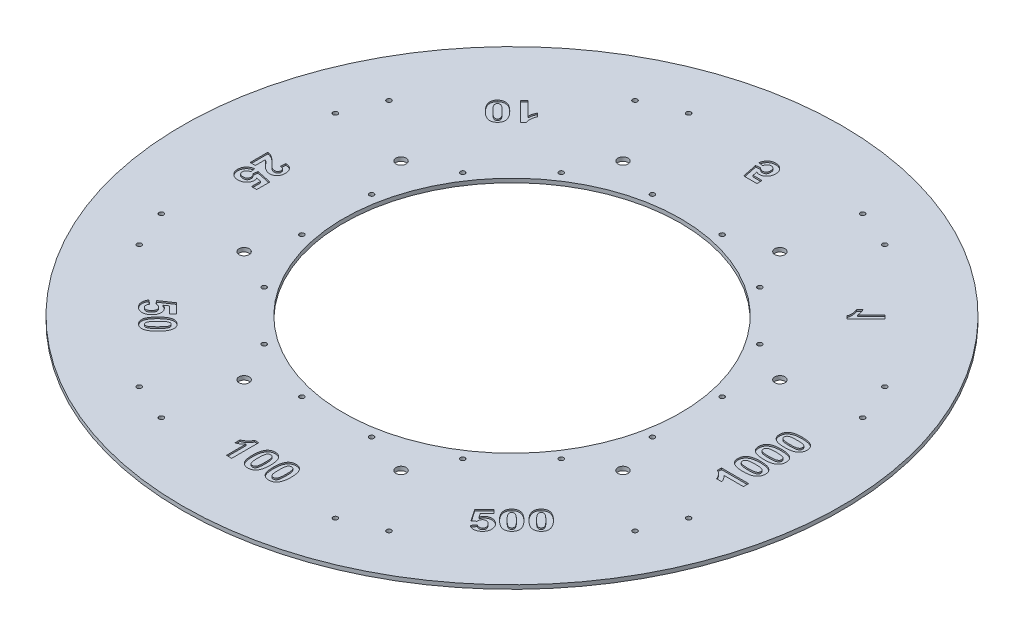
from build123d import *

# Parameters (mm, degrees)
ESQUISSE1_R                  = 225
ESQUISSE1_R_2                = 115
BOSS_EXTRU_1_DEPTH           = 2.7
ESQUISSE7_R                  = 1.6
ENL_V_MAT_EXTRU_6_DEPTH      = 319.209506458
R_P_TITION_CIRCULAIRE3_COUNT = 8
ESQUISSE6_R                  = 1.6
ENL_V_MAT_EXTRU_5_DEPTH      = 319.209506458
R_P_TITION_CIRCULAIRE2_COUNT = 8
ESQUISSE14_R                 = 3.5
ENL_V_MAT_EXTRU_12_DEPTH     = 319.209506458
R_P_TITION_CIRCULAIRE6_COUNT = 8
ENL_V_MAT_EXTRU_17_DEPTH     = 1


with BuildPart() as part:
    # Esquisse1 → Boss.-Extru.1 (new body)
    with BuildSketch(Plane(origin=(0, 0, 0), x_dir=(1, 0, 0), z_dir=(0, 1, 0))):
        with Locations(Location((0, 0, 0), (0, 0, 90))):
            Circle(ESQUISSE1_R)
        with Locations(Location((0, 0, 0), (0, 0, 90))):
            Circle(ESQUISSE1_R_2, mode=Mode.SUBTRACT)
    extrude(amount=BOSS_EXTRU_1_DEPTH)

    # Esquisse7 → Enlèv. mat.-Extru.6 (cut, through all)
    with BuildSketch(Plane(origin=(0, 0, 0), x_dir=(1, 0, 0), z_dir=(0, 1, 0))):
        with Locations(Location((-23.801019286, 119.655804209, 0), (0, 0, 90))):
            Circle(ESQUISSE7_R)
        with Locations(Location((23.801019286, 119.655804209, 0), (0, 0, 90))):
            Circle(ESQUISSE7_R)
    enl_v_mat_extru_6 = extrude(amount=ENL_V_MAT_EXTRU_6_DEPTH, mode=Mode.SUBTRACT)

    # Répétition circulaire3: Enlèv. mat.-Extru.6 ×8 about axis
    r_p_tition_circulaire3_axis = Axis((0, 0, 0), (0, 1, 0))
    for i in range(1, R_P_TITION_CIRCULAIRE3_COUNT):
        add(enl_v_mat_extru_6.rotate(r_p_tition_circulaire3_axis, i * 360 / R_P_TITION_CIRCULAIRE3_COUNT), mode=Mode.SUBTRACT)

    # Esquisse6 → Enlèv. mat.-Extru.5 (cut, through all)
    with BuildSketch(Plane(origin=(0, 0, 0), x_dir=(1, 0, 0), z_dir=(0, 1, 0))):
        with Locations(Location((85.261482172, 169.255663592, 0), (0, 0, 90))):
            Circle(ESQUISSE6_R)
        with Locations(Location((59.392855262, 179.970799698, 0), (0, 0, 90))):
            Circle(ESQUISSE6_R)
    enl_v_mat_extru_5 = extrude(amount=ENL_V_MAT_EXTRU_5_DEPTH, mode=Mode.SUBTRACT)

    # Répétition circulaire2: Enlèv. mat.-Extru.5 ×8 about axis
    r_p_tition_circulaire2_axis = Axis((0, 0, 0), (0, 1, 0))
    for i in range(1, R_P_TITION_CIRCULAIRE2_COUNT):
        add(enl_v_mat_extru_5.rotate(r_p_tition_circulaire2_axis, i * 360 / R_P_TITION_CIRCULAIRE2_COUNT), mode=Mode.SUBTRACT)

    # Esquisse14 → Enlèv. mat.-Extru.12 (cut, through all)
    with BuildSketch(Plane(origin=(0, 0, 0), x_dir=(1, 0, 0), z_dir=(0, 1, 0))):
        with Locations(Location((53.575680531, 129.343134552, 0), (0, 0, 90))):
            Circle(ESQUISSE14_R)
    enl_v_mat_extru_12 = extrude(amount=ENL_V_MAT_EXTRU_12_DEPTH, mode=Mode.SUBTRACT)

    # Répétition circulaire6: Enlèv. mat.-Extru.12 ×8 about axis
    r_p_tition_circulaire6_axis = Axis((0, 0, 0), (0, 1, 0))
    for i in range(1, R_P_TITION_CIRCULAIRE6_COUNT):
        add(enl_v_mat_extru_12.rotate(r_p_tition_circulaire6_axis, i * 360 / R_P_TITION_CIRCULAIRE6_COUNT), mode=Mode.SUBTRACT)

    # Esquisse18 → Enlèv. mat.-Extru.17 (cut)
    # profile 1 of 18: a face of its own
    with BuildSketch(Plane(origin=(0, 2.7, 0), x_dir=(1, 0, 0), z_dir=(0, 1, 0))):
        with BuildLine():
            Line((129.340129591, 125.218311636), (126.869357625, 127.689083602))
            Line((126.869357625, 127.689083602), (117.553028549, 118.372754526))
            add(Edge.make_bspline(
                [(117.553028549, 118.372754526), (117.541724482, 118.590244992), (117.519129442, 119.024973997), (117.444366756, 119.673180189), (117.333077613, 120.316308345), (117.184005366, 120.952709324), (117.002548401, 121.585015836), (116.783843899, 122.210842343), (116.527716634, 122.831070135), (116.332588382, 123.236178219), (116.234295686, 123.440244854)],
                knots=[0, 0, 0, 0, 0.990218213, 1.979289417, 2.96523145, 3.956833861, 4.950294738, 5.955446113, 6.970089095, 8, 8, 8, 8], degree=3))
            Line((116.234295686, 123.440244854), (113.989486374, 121.195435542))
            add(Edge.make_bspline(
                [(113.989486374, 121.195435542), (114.094409472, 120.968958831), (114.314506773, 120.493878376), (114.558233164, 119.707889183), (114.758473872, 118.832461157), (114.875257978, 118.050484205), (114.943937841, 117.399660468), (114.956824703, 116.913255243), (114.944391339, 116.439156064), (114.894776043, 115.978922633), (114.818371917, 115.531447134), (114.705759973, 115.098730566), (114.566860296, 114.676288174), (114.446252486, 114.406972477), (114.385847094, 114.272088011)],
                knots=[0, 0, 0, 0, 1.256532231, 2.635829084, 4.136064191, 5.778921632, 6.616561005, 7.432000484, 8.228783374, 9.004518467, 9.76248435, 10.513987556, 11.255743361, 12, 12, 12, 12], degree=3))
            Line((114.385847094, 114.272088011), (116.38987653, 112.268058575))
            Line((116.38987653, 112.268058575), (129.340129591, 125.218311636))
        make_face()
    # profile 2 of 18: a face of its own
    with BuildSketch(Plane(origin=(0, 2.7, 0), x_dir=(1, 0, 0), z_dir=(0, 1, 0))):
        with BuildLine():
            Line((-6.163964844, 174.710251324), (-3.081982422, 174.310186298))
            add(Edge.make_bspline(
                [(-3.081982422, 174.310186298), (-3.047789579, 174.519138317), (-2.981945626, 174.921509865), (-2.779231839, 175.484777333), (-2.490242165, 175.97747509), (-2.12642971, 176.395712248), (-1.711417721, 176.73312888), (-1.255243319, 176.977018199), (-0.767614595, 177.128073491), (-0.429518973, 177.146045144), (-0.259301406, 177.155093149)],
                knots=[0, 0, 0, 0, 1.155217688, 2.224562036, 3.249849536, 4.259092678, 5.238040954, 6.15568152, 7.071459712, 8, 8, 8, 8], degree=3))
            add(Edge.make_bspline(
                [(-0.259301406, 177.155093149), (-0.160401227, 177.153346109), (0.033197394, 177.149926251), (0.318570251, 177.111448146), (0.590880858, 177.048227416), (0.854595851, 176.964715157), (1.100731443, 176.846098769), (1.34261365, 176.714903933), (1.566249417, 176.548690068), (1.783274835, 176.366767844), (1.974641573, 176.153123181), (2.14866467, 175.920236338), (2.287595434, 175.656124525), (2.408816667, 175.371055522), (2.494316266, 175.056426909), (2.562972918, 174.720234284), (2.597835485, 174.357821193), (2.604427811, 174.108976169), (2.60783128, 173.980503082)],
                knots=[0, 0, 0, 0, 0.981324612, 1.920958019, 2.851674086, 3.754860667, 4.659792377, 5.559895974, 6.481852929, 7.420526383, 8.366296302, 9.322494337, 10.298829976, 11.320954175, 12.391824136, 13.528909299, 14.724231481, 16, 16, 16, 16], degree=3))
            add(Edge.make_bspline(
                [(2.60783128, 173.980503082), (2.605945989, 173.859392476), (2.602302355, 173.625326263), (2.567206428, 173.285115865), (2.515934846, 172.967853018), (2.429908668, 172.675940336), (2.334535438, 172.403733852), (2.205076327, 172.159033025), (2.061456255, 171.932690467), (1.89070045, 171.733194356), (1.700155802, 171.560384493), (1.500405831, 171.405202045), (1.281764585, 171.28026916), (1.053769027, 171.171712792), (0.810203396, 171.088932113), (0.552354592, 171.036321045), (0.282777757, 170.995930963), (0.09770824, 170.992746047), (0.003704306, 170.991128305)],
                knots=[0, 0, 0, 0, 1.291976148, 2.496956891, 3.647309563, 4.715236637, 5.740864142, 6.719181207, 7.662161057, 8.596910771, 9.510808426, 10.404242017, 11.290161478, 12.192105994, 13.09635777, 14.02682517, 14.99774852, 16, 16, 16, 16], degree=3))
            add(Edge.make_bspline(
                [(0.003704306, 170.991128305), (-0.115139976, 170.995389047), (-0.352236183, 171.003889294), (-0.702232791, 171.072988013), (-1.042898824, 171.185481208), (-1.373880201, 171.342079566), (-1.694301254, 171.544034453), (-2.002774718, 171.792015613), (-2.304595705, 172.081756542), (-2.489991668, 172.300677959), (-2.585605445, 172.413581731)],
                knots=[0, 0, 0, 0, 0.931687088, 1.85873035, 2.786835662, 3.740075265, 4.723687035, 5.750832598, 6.840042753, 8, 8, 8, 8], degree=3))
            Line((-2.585605445, 172.413581731), (-5.689813702, 171.976473647))
            Line((-5.689813702, 171.976473647), (-3.556133564, 161.74518104))
            Line((-3.556133564, 161.74518104), (5.452738131, 161.74518104))
            Line((5.452738131, 161.74518104), (5.452738131, 165.301314603))
            Line((5.452738131, 165.301314603), (-0.703818101, 165.301314603))
            Line((-0.703818101, 165.301314603), (-1.429862037, 168.601851067))
            add(Edge.make_bspline(
                [(-1.429862037, 168.601851067), (-1.244845221, 168.495102177), (-0.884542233, 168.287218673), (-0.309316116, 168.073221673), (0.268864939, 167.935874952), (0.658621067, 167.918009466), (0.851990333, 167.909145883)],
                knots=[0, 0, 0, 0, 1.060051984, 2.064352337, 3.039669322, 4, 4, 4, 4], degree=3))
            add(Edge.make_bspline(
                [(0.851990333, 167.909145883), (1.033788076, 167.914002769), (1.392909045, 167.923596998), (1.919344333, 168.003385171), (2.42566935, 168.132313413), (2.908105242, 168.321056509), (3.373271644, 168.552719036), (3.81475735, 168.842310851), (4.23216262, 169.184607722), (4.628070788, 169.572387897), (4.989192086, 170.001223807), (5.30102793, 170.46890054), (5.570369448, 170.963707678), (5.789643915, 171.491128968), (5.954764249, 172.05189364), (6.078423314, 172.641174296), (6.147696271, 173.262691667), (6.1584681, 173.686465582), (6.163964844, 173.902712661)],
                knots=[0, 0, 0, 0, 0.974449073, 1.924914406, 2.848356728, 3.770611342, 4.697465759, 5.6304258, 6.595266582, 7.587902898, 8.59846425, 9.595661498, 10.597070606, 11.615239046, 12.65218108, 13.727420151, 14.840327981, 16, 16, 16, 16], degree=3))
            add(Edge.make_bspline(
                [(6.163964844, 173.902712661), (6.159176914, 174.08560586), (6.149737761, 174.446170189), (6.090187043, 174.980463241), (5.986943015, 175.498474091), (5.839361985, 176.001322754), (5.661288559, 176.492073997), (5.430332445, 176.964095645), (5.167032039, 177.425150247), (4.957848314, 177.713757788), (4.852640592, 177.85891125)],
                knots=[0, 0, 0, 0, 1.034484125, 2.039431075, 3.036557497, 4.017955309, 5.001314354, 5.985293229, 6.986715104, 8, 8, 8, 8], degree=3))
            add(Edge.make_bspline(
                [(4.852640592, 177.85891125), (4.699852277, 178.047696541), (4.399147101, 178.419247955), (3.884537504, 178.908034441), (3.322867627, 179.318418001), (2.720962861, 179.658500063), (2.072915416, 179.919155304), (1.382664096, 180.103543293), (0.649533896, 180.217009046), (0.14611847, 180.230289299), (-0.111129174, 180.237075571)],
                knots=[0, 0, 0, 0, 1.018083256, 2.003706276, 2.967234879, 3.929718629, 4.896430529, 5.889106397, 6.921323468, 8, 8, 8, 8], degree=3))
            add(Edge.make_bspline(
                [(-0.111129174, 180.237075571), (-0.318777128, 180.233312255), (-0.724221093, 180.225964176), (-1.318047854, 180.153715818), (-1.881717218, 180.035176141), (-2.417576739, 179.874000612), (-2.922279799, 179.660319291), (-3.397015645, 179.400213345), (-3.845323257, 179.095597219), (-4.25776134, 178.742051821), (-4.640659033, 178.355727932), (-4.978410441, 177.928638176), (-5.280442317, 177.472363736), (-5.539010325, 176.981568604), (-5.759445544, 176.460079002), (-5.934945875, 175.905116674), (-6.079449557, 175.320411761), (-6.135481252, 174.915889401), (-6.163964844, 174.710251324)],
                knots=[0, 0, 0, 0, 1.099003768, 2.145864841, 3.161350431, 4.145719637, 5.103728611, 6.05748998, 7.007659691, 7.967785421, 8.929356772, 9.882961289, 10.845776358, 11.822561646, 12.815770114, 13.839158434, 14.901540813, 16, 16, 16, 16], degree=3))
        make_face()
    # profile 3 of 18: a face of its own
    with BuildSketch(Plane(origin=(0, 2.7, 0), x_dir=(1, 0, 0), z_dir=(0, 1, 0))):
        with BuildLine():
            Line((-124.310997275, 130.247443952), (-121.84022531, 132.718215917))
            Line((-121.84022531, 132.718215917), (-112.523896234, 123.401886842))
            add(Edge.make_bspline(
                [(-112.523896234, 123.401886842), (-112.512592167, 123.619377308), (-112.489997126, 124.054106312), (-112.415234441, 124.702312505), (-112.303945298, 125.34544066), (-112.154873051, 125.981841639), (-111.973416086, 126.614148151), (-111.754711584, 127.239974658), (-111.498584319, 127.86020245), (-111.303456067, 128.265310534), (-111.205163371, 128.46937717)],
                knots=[0, 0, 0, 0, 0.990218213, 1.979289417, 2.96523145, 3.956833861, 4.950294738, 5.955446113, 6.970089095, 8, 8, 8, 8], degree=3))
            Line((-111.205163371, 128.46937717), (-108.960354059, 126.224567858))
            add(Edge.make_bspline(
                [(-108.960354059, 126.224567858), (-109.065254599, 125.998087851), (-109.28530458, 125.523000485), (-109.529423998, 124.7370687), (-109.728003028, 123.861207108), (-109.850676324, 123.079898048), (-109.918010793, 122.428787482), (-109.932817943, 121.942300125), (-109.913943015, 121.468376477), (-109.865984727, 121.008043348), (-109.789149979, 120.560582499), (-109.676651123, 120.127862084), (-109.537722123, 119.705420689), (-109.417118216, 119.436104859), (-109.356714779, 119.301220326)],
                knots=[0, 0, 0, 0, 1.256409455, 2.635571536, 4.135660055, 5.779310917, 6.616868444, 7.432228246, 8.22915186, 9.004811156, 9.762702978, 10.514132755, 11.255816082, 12, 12, 12, 12], degree=3))
            Line((-109.356714779, 119.301220326), (-111.360744214, 117.297190891))
            Line((-111.360744214, 117.297190891), (-124.310997275, 130.247443952))
        make_face()
    # profile 4 of 18: a face of its own
    with BuildSketch(Plane(origin=(0, 2.7, 0), x_dir=(1, 0, 0), z_dir=(0, 1, 0))):
        with BuildLine():
            add(Edge.make_bspline(
                [(-119.274215789, 109.383719315), (-119.430837428, 109.236179569), (-119.737106474, 108.947669901), (-120.231340405, 108.576036047), (-120.741809514, 108.270877664), (-121.272270252, 108.041710276), (-121.81694624, 107.871653667), (-122.379220229, 107.771669409), (-122.958121291, 107.740211506), (-123.345405082, 107.773835998), (-123.541576066, 107.790867823)],
                knots=[0, 0, 0, 0, 1.092440254, 2.136235045, 3.134576453, 4.106516509, 5.064860047, 6.027075779, 7.000654056, 8, 8, 8, 8], degree=3))
            add(Edge.make_bspline(
                [(-123.541576066, 107.790867823), (-123.783752725, 107.829102373), (-124.284716814, 107.908193961), (-125.037130472, 108.155713053), (-125.813207254, 108.504169715), (-126.614856538, 108.956767356), (-127.441826943, 109.513634652), (-128.296446348, 110.170688438), (-129.177183689, 110.932548736), (-129.751822553, 111.49560564), (-130.050041349, 111.787813777)],
                knots=[0, 0, 0, 0, 0.756428127, 1.564739264, 2.43737051, 3.381811879, 4.404893829, 5.515017744, 6.710375401, 8, 8, 8, 8], degree=3))
            add(Edge.make_bspline(
                [(-130.050041349, 111.787813777), (-130.340944513, 112.086127699), (-130.902039433, 112.661516512), (-131.661699838, 113.541447389), (-132.323646457, 114.39179399), (-132.871684661, 115.223874938), (-133.328615384, 116.025957729), (-133.674047092, 116.807385631), (-133.92199665, 117.565771159), (-134.003671382, 118.070170703), (-134.043282996, 118.314800588)],
                knots=[0, 0, 0, 0, 1.284704402, 2.477941806, 3.583076479, 4.605408048, 5.548174223, 6.426221121, 7.23672939, 8, 8, 8, 8], degree=3))
            add(Edge.make_bspline(
                [(-134.043282996, 118.314800588), (-134.058690633, 118.508513332), (-134.089207067, 118.892181657), (-134.059445732, 119.464931988), (-133.957835926, 120.021940977), (-133.789880206, 120.563017239), (-133.553779107, 121.088348699), (-133.25229835, 121.598935807), (-132.877657488, 122.089835693), (-132.590312336, 122.395729283), (-132.443022893, 122.552526418)],
                knots=[0, 0, 0, 0, 0.992115737, 1.96498886, 2.920316422, 3.878140489, 4.852444458, 5.856523438, 6.901281378, 8, 8, 8, 8], degree=3))
            add(Edge.make_bspline(
                [(-132.443022893, 122.552526418), (-132.285757581, 122.70204952), (-131.977811218, 122.994835608), (-131.468189491, 123.36200569), (-130.939164511, 123.666694588), (-130.384967642, 123.899559419), (-129.810139251, 124.069647258), (-129.211410462, 124.164380434), (-128.591429182, 124.19472506), (-128.061391568, 124.158143547), (-127.625952818, 124.098165082), (-127.287537775, 124.017364142), (-126.939953054, 123.913816312), (-126.582811498, 123.784640125), (-126.220694757, 123.621693892), (-125.844947194, 123.442617531), (-125.464468601, 123.229560712), (-125.074631924, 122.991380805), (-124.675249404, 122.728708534), (-124.266491911, 122.439714524), (-123.852579262, 122.119060397), (-123.426708649, 121.775681823), (-122.993333041, 121.404864901), (-122.552718904, 121.006738654), (-122.099218508, 120.585942837), (-121.800892919, 120.288887846), (-121.648675804, 120.13731904)],
                knots=[0, 0, 0, 0, 1.245619442, 2.439088263, 3.598932683, 4.746670632, 5.884962381, 7.035022403, 8.221214681, 9.444015325, 10.08215411, 10.74475028, 11.440620765, 12.165577232, 12.924854697, 13.721308551, 14.556509846, 15.428940942, 16.34592993, 17.302651558, 18.304503299, 19.353816132, 20.445795026, 21.581186607, 22.765828986, 24, 24, 24, 24], degree=3))
            add(Edge.make_bspline(
                [(-121.648675804, 120.13731904), (-121.359074157, 119.840195612), (-120.800573506, 119.267189108), (-120.04368726, 118.391565088), (-119.387690608, 117.541796027), (-118.831155825, 116.717187009), (-118.382807727, 115.911559394), (-118.040562662, 115.130206618), (-117.785866195, 114.375282919), (-117.707980161, 113.869941793), (-117.67025138, 113.625149451)],
                knots=[0, 0, 0, 0, 1.282565928, 2.473445549, 3.576030213, 4.599888134, 5.546524925, 6.421768371, 7.235488672, 8, 8, 8, 8], degree=3))
            add(Edge.make_bspline(
                [(-117.67025138, 113.625149451), (-117.65432117, 113.430172253), (-117.622963213, 113.04636774), (-117.659659154, 112.472775568), (-117.758503958, 111.915415994), (-117.927504903, 111.373242696), (-118.163418784, 110.847893078), (-118.464951828, 110.337311042), (-118.839578096, 109.84640974), (-119.126925296, 109.540516349), (-119.274215789, 109.383719315)],
                knots=[0, 0, 0, 0, 0.997596703, 1.963727654, 2.924476218, 3.881515915, 4.855022018, 5.858278749, 6.902181128, 8, 8, 8, 8], degree=3))
        make_face()
        with BuildLine():
            add(Edge.make_bspline(
                [(-121.322696894, 111.43220042), (-121.253043805, 111.508941764), (-121.115912222, 111.660028556), (-120.963009766, 111.924946464), (-120.8574426, 112.211715565), (-120.800553925, 112.524763974), (-120.803773853, 112.872758037), (-120.893214123, 113.252312451), (-121.051326699, 113.668394146), (-121.204005951, 113.944330317), (-121.285653836, 114.091891982)],
                knots=[0, 0, 0, 0, 0.858133829, 1.68947639, 2.519491482, 3.383844196, 4.316457663, 5.385778736, 6.601999728, 8, 8, 8, 8], degree=3))
            add(Edge.make_bspline(
                [(-121.285653836, 114.091891982), (-121.350995875, 114.198960272), (-121.491512602, 114.429208458), (-121.746563409, 114.778906101), (-122.048758374, 115.162841424), (-122.389499086, 115.588092665), (-122.795330795, 116.032061941), (-123.237773832, 116.519119773), (-123.731342782, 117.038300281), (-124.081688682, 117.390663262), (-124.263915696, 117.573939429)],
                knots=[0, 0, 0, 0, 0.655372861, 1.409366042, 2.26012083, 3.209622638, 4.256356212, 5.402904576, 6.649160884, 8, 8, 8, 8], degree=3))
            add(Edge.make_bspline(
                [(-124.263915696, 117.573939429), (-124.446347284, 117.754528491), (-124.796963329, 118.101603375), (-125.305346913, 118.594927501), (-125.782152674, 119.031777629), (-126.215831414, 119.422443012), (-126.618497618, 119.755525009), (-126.97826793, 120.043039995), (-127.306006803, 120.273696797), (-127.676243203, 120.507723045), (-128.092539959, 120.724453004), (-128.544741146, 120.917929356), (-128.949537147, 121.017357051), (-129.305592217, 121.032322517), (-129.620632358, 120.972874363), (-129.904052907, 120.863943577), (-130.167317102, 120.709858669), (-130.317737615, 120.573612247), (-130.394541788, 120.504045314)],
                knots=[0, 0, 0, 0, 1.650156915, 3.171443592, 4.553295498, 5.807041132, 6.922928304, 7.912188497, 8.766639385, 9.49779326, 10.72625835, 11.780151791, 12.652336459, 13.390906442, 14.052580364, 14.698254559, 15.335333461, 16, 16, 16, 16], degree=3))
            add(Edge.make_bspline(
                [(-130.394541788, 120.504045314), (-130.464301105, 120.42734273), (-130.601641827, 120.276332248), (-130.753230246, 120.010476857), (-130.864715375, 119.725395459), (-130.919699698, 119.411422715), (-130.918720479, 119.064153132), (-130.82172298, 118.687213166), (-130.666926752, 118.270557184), (-130.511258518, 117.995423384), (-130.42788054, 117.848058058)],
                knots=[0, 0, 0, 0, 0.858072342, 1.689355335, 2.522908908, 3.387199689, 4.319746333, 5.381204324, 6.597338171, 8, 8, 8, 8], degree=3))
            add(Edge.make_bspline(
                [(-130.42788054, 117.848058058), (-130.364001601, 117.740841021), (-130.227129059, 117.511108521), (-129.972692283, 117.164835312), (-129.67824757, 116.778134553), (-129.327726352, 116.363133165), (-128.936810771, 115.908541861), (-128.488283834, 115.429065477), (-127.997483203, 114.908635806), (-127.646825235, 114.556550804), (-127.464435903, 114.373419222)],
                knots=[0, 0, 0, 0, 0.654063209, 1.401452421, 2.25098364, 3.202662345, 4.249067336, 5.394541729, 6.644811078, 8, 8, 8, 8], degree=3))
            add(Edge.make_bspline(
                [(-127.464435903, 114.373419222), (-127.282005575, 114.192828387), (-126.931391952, 113.845750092), (-126.422991798, 113.352449296), (-125.946240762, 112.915522119), (-125.512386051, 112.525104494), (-125.110274238, 112.191241944), (-124.749010479, 111.906324761), (-124.426694611, 111.668529956), (-124.054510478, 111.435998088), (-123.637899198, 111.217749515), (-123.180464194, 111.032374966), (-122.77741419, 110.920744217), (-122.417674534, 110.90804367), (-122.102231829, 110.967328838), (-121.815437748, 111.072412913), (-121.550526378, 111.225441806), (-121.399438692, 111.362556108), (-121.322696894, 111.43220042)],
                knots=[0, 0, 0, 0, 1.647528224, 3.166391499, 4.546042121, 5.797790545, 6.911900115, 7.899584421, 8.750831724, 9.480820875, 10.714349591, 11.76360554, 12.645829212, 13.383222657, 14.051639542, 14.693502631, 15.336392271, 16, 16, 16, 16], degree=3))
        make_face(mode=Mode.SUBTRACT)
    # profile 5 of 18: a face of its own
    with BuildSketch(Plane(origin=(0, 2.7, 0), x_dir=(1, 0, 0), z_dir=(0, 1, 0))):
        with BuildLine():
            Line((-176.443866436, 1.185377855), (-180, 1.185377855))
            Line((-180, 1.185377855), (-180, 13.276231971))
            add(Edge.make_bspline(
                [(-180, 13.276231971), (-179.696103902, 13.235215759), (-179.088482104, 13.153206332), (-178.199976138, 12.901221114), (-177.334937774, 12.558663809), (-176.63167253, 12.190572998), (-176.059806502, 11.832644949), (-175.599996224, 11.495875757), (-175.101023601, 11.106996673), (-174.574551663, 10.65300898), (-174.010357056, 10.14523907), (-173.413413703, 9.577371514), (-172.785882203, 8.947615344), (-172.359787753, 8.50452963), (-172.139463102, 8.275419147)],
                knots=[0, 0, 0, 0, 1.156381417, 2.312114436, 3.475445649, 4.663832578, 5.302694182, 6.020660876, 6.814180865, 7.69035705, 8.644181007, 9.679458435, 10.800095821, 12, 12, 12, 12], degree=3))
            add(Edge.make_bspline(
                [(-172.139463102, 8.275419147), (-171.963015301, 8.092554667), (-171.627110656, 7.744434555), (-171.145594496, 7.249247233), (-170.70531943, 6.812705779), (-170.309084404, 6.432285559), (-169.961354265, 6.102923048), (-169.654077886, 5.833472433), (-169.393010502, 5.615530874), (-169.227268, 5.497606581), (-169.153792631, 5.445329519)],
                knots=[0, 0, 0, 0, 1.480739016, 2.818890974, 4.024686436, 5.093297083, 6.019761393, 6.815071481, 7.474708909, 8, 8, 8, 8], degree=3))
            add(Edge.make_bspline(
                [(-169.153792631, 5.445329519), (-168.976143199, 5.337727181), (-168.633881976, 5.130419409), (-168.091941619, 4.911122714), (-167.554765113, 4.767994203), (-167.193829078, 4.750239084), (-167.016408187, 4.741511418)],
                knots=[0, 0, 0, 0, 1.091434863, 2.102769638, 3.067401785, 4, 4, 4, 4], degree=3))
            add(Edge.make_bspline(
                [(-167.016408187, 4.741511418), (-166.83185175, 4.748047581), (-166.482685365, 4.760413491), (-165.991296335, 4.867537103), (-165.56587839, 5.049276613), (-165.211453042, 5.308407433), (-164.931345089, 5.634770824), (-164.727649759, 6.018607651), (-164.6126939, 6.461263416), (-164.597847328, 6.772037145), (-164.590087891, 6.934460449)],
                knots=[0, 0, 0, 0, 1.192552326, 2.256215989, 3.232470907, 4.163657734, 5.069678789, 5.991331675, 6.950186205, 8, 8, 8, 8], degree=3))
            add(Edge.make_bspline(
                [(-164.590087891, 6.934460449), (-164.597395361, 7.095751139), (-164.611511816, 7.407329928), (-164.734831233, 7.850150991), (-164.948310116, 8.237537693), (-165.191589897, 8.51361006), (-165.428161814, 8.700110039), (-165.634318655, 8.827184619), (-165.868576048, 8.936712986), (-166.128296646, 9.033764258), (-166.416455822, 9.11042379), (-166.730858952, 9.172160616), (-167.073197973, 9.221911567), (-167.311353432, 9.237733247), (-167.434994742, 9.245947266)],
                knots=[0, 0, 0, 0, 1.402788338, 2.709884207, 3.961032948, 5.225417836, 5.883680772, 6.578928686, 7.329201998, 8.132101139, 8.990263233, 9.922304639, 10.921339128, 12, 12, 12, 12], degree=3))
            Line((-167.434994742, 9.245947266), (-167.086789997, 12.802080829))
            add(Edge.make_bspline(
                [(-167.086789997, 12.802080829), (-166.846706159, 12.773490066), (-166.381221956, 12.718057145), (-165.712626145, 12.57972336), (-165.095816329, 12.404528747), (-164.531937196, 12.18412119), (-164.01740302, 11.927610399), (-163.55993471, 11.621912189), (-163.15446481, 11.277707981), (-162.801209119, 10.894700303), (-162.499043839, 10.475324062), (-162.229314959, 10.035263946), (-162.008051534, 9.565919951), (-161.825697228, 9.072459571), (-161.679961125, 8.555105808), (-161.583602389, 8.011465831), (-161.515823285, 7.444894785), (-161.510716847, 7.058151024), (-161.508105469, 6.860374333)],
                knots=[0, 0, 0, 0, 1.270971563, 2.464210789, 3.586263665, 4.638946707, 5.643716971, 6.603612468, 7.52484387, 8.434700188, 9.336036235, 10.239171475, 11.145359471, 12.059630629, 13.003312604, 13.96741569, 14.960557767, 16, 16, 16, 16], degree=3))
            add(Edge.make_bspline(
                [(-161.508105469, 6.860374333), (-161.512237428, 6.645365238), (-161.520284939, 6.22660803), (-161.586753249, 5.615301516), (-161.702621233, 5.041005578), (-161.856199297, 4.498779098), (-162.060901035, 3.993908547), (-162.310029073, 3.522298242), (-162.60753364, 3.088740371), (-162.945146294, 2.692767512), (-163.312565202, 2.337367396), (-163.710673079, 2.033096521), (-164.123871899, 1.765966297), (-164.566072999, 1.55626962), (-165.026184062, 1.385423262), (-165.512323333, 1.275494206), (-166.01729004, 1.195108826), (-166.362876866, 1.188657385), (-166.538552739, 1.185377855)],
                knots=[0, 0, 0, 0, 1.21054264, 2.357683783, 3.456743179, 4.506371233, 5.526380269, 6.518616322, 7.504105716, 8.480749833, 9.444588379, 10.376395364, 11.298423092, 12.209585683, 13.126776925, 14.056012185, 15.011791738, 16, 16, 16, 16], degree=3))
            add(Edge.make_bspline(
                [(-166.538552739, 1.185377855), (-166.740118971, 1.189910447), (-167.139995442, 1.198902414), (-167.731201008, 1.284713014), (-168.30850253, 1.416461246), (-168.875083225, 1.608919699), (-169.438407183, 1.861745865), (-170.012362034, 2.171254624), (-170.596458511, 2.546142003), (-170.979252677, 2.831393279), (-171.176343595, 2.97826186)],
                knots=[0, 0, 0, 0, 0.953498, 1.891593709, 2.82157134, 3.753035249, 4.718494268, 5.740911752, 6.836853288, 8, 8, 8, 8], degree=3))
            add(Edge.make_bspline(
                [(-171.176343595, 2.97826186), (-171.247233244, 3.034454002), (-171.399062442, 3.154804546), (-171.63016907, 3.360168124), (-171.888450175, 3.593248895), (-172.163017459, 3.864734662), (-172.465735664, 4.164654509), (-172.785183895, 4.500955459), (-173.127034389, 4.870239897), (-173.484357021, 5.257666724), (-173.830945481, 5.648973791), (-174.161138869, 6.006723398), (-174.457976428, 6.327239817), (-174.724870849, 6.607428329), (-174.956680435, 6.852210166), (-175.158218745, 7.056915823), (-175.326458745, 7.224843078), (-175.588635966, 7.456292763), (-175.943251557, 7.750767291), (-176.282089426, 7.957947571), (-176.443866436, 8.056865105)],
                knots=[0, 0, 0, 0, 0.665546509, 1.425446362, 2.274432636, 3.225431318, 4.2662943, 5.410247296, 6.638261485, 7.969509561, 9.288545809, 10.484715594, 11.551975365, 12.503234464, 13.332293902, 14.032657109, 14.617374704, 15.080693821, 16.606187002, 18, 18, 18, 18], degree=3))
            Line((-176.443866436, 8.056865105), (-176.443866436, 1.185377855))
        make_face()
    # profile 6 of 18: a face of its own
    with BuildSketch(Plane(origin=(0, 2.7, 0), x_dir=(1, 0, 0), z_dir=(0, 1, 0))):
        with BuildLine():
            Line((-174.710251324, -0.948302284), (-174.310186298, -4.030284706))
            add(Edge.make_bspline(
                [(-174.310186298, -4.030284706), (-174.519138317, -4.064477548), (-174.921509865, -4.130321501), (-175.484777333, -4.333035288), (-175.97747509, -4.622024962), (-176.395712248, -4.985837417), (-176.73312888, -5.400849406), (-176.977018199, -5.857023808), (-177.128073491, -6.344652533), (-177.146045144, -6.682748154), (-177.155093149, -6.852965722)],
                knots=[0, 0, 0, 0, 1.155217688, 2.224562036, 3.249849536, 4.259092678, 5.238040954, 6.15568152, 7.071459712, 8, 8, 8, 8], degree=3))
            add(Edge.make_bspline(
                [(-177.155093149, -6.852965722), (-177.153355788, -6.951870631), (-177.149954876, -7.145478512), (-177.111339728, -7.430784388), (-177.048625231, -7.703342421), (-176.963435307, -7.965672755), (-176.8516652, -8.21525777), (-176.713378222, -8.452387493), (-176.553276663, -8.679981859), (-176.369998146, -8.895143851), (-176.156617645, -9.088249042), (-175.920596708, -9.259753173), (-175.656273528, -9.40006384), (-175.371012753, -9.521026021), (-175.056439373, -9.60660023), (-174.72023069, -9.675235189), (-174.357822183, -9.710103949), (-174.108976505, -9.716695393), (-173.980503082, -9.720098407)],
                knots=[0, 0, 0, 0, 0.98109136, 1.920501424, 2.850996269, 3.75396817, 4.653607445, 5.559568228, 6.474190795, 7.412641135, 8.358186253, 9.324081521, 10.300185094, 11.322066343, 12.392681767, 13.529496655, 14.72453472, 16, 16, 16, 16], degree=3))
            add(Edge.make_bspline(
                [(-173.980503082, -9.720098407), (-173.859400002, -9.718175996), (-173.625348337, -9.714460618), (-173.286246997, -9.679990598), (-172.969353626, -9.627079326), (-172.67698534, -9.54290578), (-172.40370642, -9.446773164), (-172.159204723, -9.31716144), (-171.932851729, -9.174946758), (-171.736884512, -9.001599716), (-171.563667072, -8.812753979), (-171.409580765, -8.611519041), (-171.279530378, -8.395209561), (-171.171985196, -8.165872418), (-171.088856818, -7.922515782), (-171.036342331, -7.664608925), (-170.995925344, -7.395048262), (-170.992744154, -7.209976505), (-170.991128305, -7.115971433)],
                knots=[0, 0, 0, 0, 1.292262537, 2.497510385, 3.635136149, 4.715991128, 5.741845981, 6.720379908, 7.663568786, 8.58853187, 9.502632107, 10.396263742, 11.289117461, 12.191261909, 13.095714127, 14.026387781, 14.997526353, 16, 16, 16, 16], degree=3))
            add(Edge.make_bspline(
                [(-170.991128305, -7.115971433), (-170.995389047, -6.997127151), (-171.003889294, -6.760030945), (-171.072988013, -6.410034337), (-171.185481208, -6.069368303), (-171.342079566, -5.738386927), (-171.544034453, -5.417965874), (-171.792015613, -5.109492409), (-172.081756542, -4.807671422), (-172.300677959, -4.622275459), (-172.413581731, -4.526661682)],
                knots=[0, 0, 0, 0, 0.931687088, 1.85873035, 2.786835662, 3.740075265, 4.723687035, 5.750832598, 6.840042753, 8, 8, 8, 8], degree=3))
            Line((-172.413581731, -4.526661682), (-171.976473647, -1.422453425))
            Line((-171.976473647, -1.422453425), (-161.74518104, -3.556133564))
            Line((-161.74518104, -3.556133564), (-161.74518104, -12.565005258))
            Line((-161.74518104, -12.565005258), (-165.301314603, -12.565005258))
            Line((-165.301314603, -12.565005258), (-165.301314603, -6.408449026))
            Line((-165.301314603, -6.408449026), (-168.601851067, -5.68240509))
            add(Edge.make_bspline(
                [(-168.601851067, -5.68240509), (-168.495102177, -5.867421907), (-168.287218673, -6.227724894), (-168.073221673, -6.802951012), (-167.935874952, -7.381132066), (-167.918009466, -7.770888195), (-167.909145883, -7.96425746)],
                knots=[0, 0, 0, 0, 1.060051984, 2.064352337, 3.039669322, 4, 4, 4, 4], degree=3))
            add(Edge.make_bspline(
                [(-167.909145883, -7.96425746), (-167.914037747, -8.146041005), (-167.923701072, -8.505133926), (-168.002985579, -9.031773666), (-168.133654586, -9.536921301), (-168.315494188, -10.022282594), (-168.553838461, -10.484385903), (-168.841913774, -10.927214865), (-169.184719025, -11.344376381), (-169.572357097, -11.740352683), (-170.001231999, -12.101455286), (-170.468898349, -12.413296109), (-170.963708276, -12.682636288), (-171.491128803, -12.901911122), (-172.051893687, -13.067031354), (-172.641174283, -13.190690447), (-173.26269167, -13.259963396), (-173.686465584, -13.270735227), (-173.902712661, -13.276231971)],
                knots=[0, 0, 0, 0, 0.974409932, 1.924837087, 2.848242317, 3.768103797, 4.697919751, 5.630842317, 6.595644344, 7.588240789, 8.59876155, 9.595918743, 10.597287627, 11.615415169, 12.652315553, 13.727511434, 14.840374562, 16, 16, 16, 16], degree=3))
            add(Edge.make_bspline(
                [(-173.902712661, -13.276231971), (-174.084353511, -13.271307719), (-174.444874302, -13.261534061), (-174.978174965, -13.203396753), (-175.496863134, -13.097806293), (-175.999479481, -12.953432171), (-176.48989941, -12.771401733), (-176.962892515, -12.544990442), (-177.422475253, -12.276988758), (-177.712299197, -12.06974518), (-177.85891125, -11.96490772)],
                knots=[0, 0, 0, 0, 1.0275977, 2.039576086, 3.029943557, 4.018141221, 4.995043124, 5.985410594, 6.980887897, 8, 8, 8, 8], degree=3))
            add(Edge.make_bspline(
                [(-177.85891125, -11.96490772), (-178.047729519, -11.812136716), (-178.419345835, -11.511465611), (-178.907660949, -10.996608566), (-179.319426835, -10.436338589), (-179.653067223, -9.831217421), (-179.920492521, -9.186271188), (-180.103133657, -8.494752046), (-180.217118591, -7.761848939), (-180.230326346, -7.258401802), (-180.237075571, -7.001137954)],
                knots=[0, 0, 0, 0, 1.018155984, 2.003849412, 2.967446846, 3.927472908, 4.896208823, 5.888955604, 6.921246412, 8, 8, 8, 8], degree=3))
            add(Edge.make_bspline(
                [(-180.237075571, -7.001137954), (-180.233310197, -6.793491129), (-180.225958098, -6.388049372), (-180.153738506, -5.794206817), (-180.035094835, -5.230594552), (-179.874290829, -4.694531039), (-179.659500814, -4.191106727), (-179.40468987, -3.714141357), (-179.098844917, -3.267273845), (-178.745900628, -2.853132731), (-178.355727404, -2.472860058), (-177.92882518, -2.133667453), (-177.472312644, -1.831876512), (-176.98158262, -1.573242619), (-176.460075099, -1.352825533), (-175.905117772, -1.177320142), (-175.320411471, -1.032817863), (-174.915889303, -0.976785974), (-174.710251324, -0.948302284)],
                knots=[0, 0, 0, 0, 1.098896741, 2.145655864, 3.16104256, 4.145315902, 5.10323158, 6.053780891, 7.003858069, 7.963890296, 8.930045353, 9.883557002, 10.846278307, 11.82296847, 12.816080213, 13.83936887, 14.901647787, 16, 16, 16, 16], degree=3))
        make_face()
    # profile 7 of 18: a face of its own
    with BuildSketch(Plane(origin=(0, 2.7, 0), x_dir=(1, 0, 0), z_dir=(0, 1, 0))):
        with BuildLine():
            Line((-133.222001506, -114.705732348), (-130.503041052, -116.913498602))
            add(Edge.make_bspline(
                [(-130.503041052, -116.913498602), (-130.613138335, -117.068376159), (-130.825827912, -117.367573751), (-131.05268814, -117.857094358), (-131.181189622, -118.356979633), (-131.214332845, -118.856791276), (-131.159673316, -119.340254527), (-131.02137068, -119.789542912), (-130.805402488, -120.203787409), (-130.597472959, -120.431722804), (-130.491928134, -120.547422587)],
                knots=[0, 0, 0, 0, 1.1436651, 2.209370098, 3.231151852, 4.238215226, 5.212252019, 6.146930295, 7.059383635, 8, 8, 8, 8], degree=3))
            add(Edge.make_bspline(
                [(-130.491928134, -120.547422587), (-130.426675093, -120.609613526), (-130.298588604, -120.731689354), (-130.083507982, -120.884307805), (-129.858190456, -121.011785292), (-129.61779029, -121.10643027), (-129.369618576, -121.183379934), (-129.106785021, -121.226087343), (-128.832615558, -121.245542363), (-128.547174743, -121.232985687), (-128.253431281, -121.193915711), (-127.95536947, -121.114262016), (-127.654118254, -120.998011906), (-127.349992378, -120.845776711), (-127.044553035, -120.653239712), (-126.735288117, -120.427964194), (-126.420633537, -120.167240326), (-126.22067864, -119.971096779), (-126.11714299, -119.869534627)],
                knots=[0, 0, 0, 0, 0.8692114, 1.706192292, 2.538662043, 3.36212165, 4.19561493, 5.042217578, 5.92634102, 6.844910857, 7.795710294, 8.781653455, 9.81550635, 10.908357321, 12.059466465, 13.296954547, 14.600376516, 16, 16, 16, 16], degree=3))
            add(Edge.make_bspline(
                [(-126.11714299, -119.869534627), (-126.023460804, -119.771756219), (-125.841834675, -119.582188548), (-125.595117402, -119.289813968), (-125.388377831, -118.995850144), (-125.210578141, -118.707084104), (-125.074527804, -118.416680005), (-124.967173753, -118.130114605), (-124.90155443, -117.843520257), (-124.866449491, -117.560270375), (-124.868752496, -117.282082363), (-124.892617973, -117.011182674), (-124.948947925, -116.7487888), (-125.035822349, -116.496369146), (-125.145790009, -116.250245533), (-125.28944492, -116.015429747), (-125.459997889, -115.787669651), (-125.593323869, -115.647787082), (-125.661513377, -115.57624421)],
                knots=[0, 0, 0, 0, 1.330673585, 2.579840465, 3.754902923, 4.859960295, 5.907558038, 6.901789077, 7.861351445, 8.790032542, 9.700134936, 10.590031218, 11.458743434, 12.329825484, 13.20957021, 14.102357516, 15.029451665, 16, 16, 16, 16], degree=3))
            add(Edge.make_bspline(
                [(-125.661513377, -115.57624421), (-125.752127325, -115.491114722), (-125.931983023, -115.322144892), (-126.236659328, -115.111550981), (-126.559661571, -114.932074259), (-126.907142318, -114.788980483), (-127.279079638, -114.692041941), (-127.671863055, -114.625244395), (-128.086066243, -114.58931689), (-128.369324719, -114.600176214), (-128.513828839, -114.605716091)],
                knots=[0, 0, 0, 0, 0.959014128, 1.903505585, 2.851024959, 3.809042954, 4.796784117, 5.812663926, 6.884131972, 8, 8, 8, 8], degree=3))
            Line((-128.513828839, -114.605716091), (-130.228922423, -112.312750804))
            Line((-130.228922423, -112.312750804), (-122.249847739, -106.867421284))
            Line((-122.249847739, -106.867421284), (-115.71174801, -113.405521013))
            Line((-115.71174801, -113.405521013), (-118.023234827, -115.71700783))
            Line((-118.023234827, -115.71700783), (-122.686955823, -111.053286833))
            Line((-122.686955823, -111.053286833), (-125.268856963, -112.857283756))
            add(Edge.make_bspline(
                [(-125.268856963, -112.857283756), (-125.066489301, -112.929803), (-124.668802495, -113.072315625), (-124.119401271, -113.374093316), (-123.606784364, -113.713211427), (-123.311789071, -113.992441818), (-123.164811271, -114.131564949)],
                knots=[0, 0, 0, 0, 1.037815828, 2.03948427, 3.023196991, 4, 4, 4, 4], degree=3))
            add(Edge.make_bspline(
                [(-123.164811271, -114.131564949), (-123.033110187, -114.269539786), (-122.773897932, -114.541099956), (-122.446396719, -114.991483376), (-122.158958897, -115.455021219), (-121.933961058, -115.945932557), (-121.761666166, -116.458836106), (-121.644071758, -116.992954793), (-121.57752675, -117.548714133), (-121.562943248, -118.119224143), (-121.602462375, -118.695203778), (-121.702431709, -119.264098295), (-121.863753098, -119.818233148), (-122.078974164, -120.358887252), (-122.356295904, -120.884166417), (-122.691419596, -121.394959004), (-123.081701035, -121.895735124), (-123.379288908, -122.206993926), (-123.531537544, -122.366236733)],
                knots=[0, 0, 0, 0, 0.992297943, 1.953027115, 2.89374887, 3.828827214, 4.758138891, 5.706718096, 6.671827515, 7.668885506, 8.674532931, 9.673600348, 10.670844951, 11.675093357, 12.699077166, 13.758528659, 14.853243077, 16, 16, 16, 16], degree=3))
            add(Edge.make_bspline(
                [(-123.531537544, -122.366236733), (-123.665506825, -122.494252756), (-123.930997113, -122.747945325), (-124.358285513, -123.088928552), (-124.803430878, -123.389056174), (-125.265443556, -123.652003735), (-125.748117374, -123.86820047), (-126.24709686, -124.052786916), (-126.765768743, -124.193152482), (-127.120472801, -124.256779858), (-127.298816539, -124.288771441)],
                knots=[0, 0, 0, 0, 1.03309576, 2.047311822, 3.04436132, 4.024983836, 5.008142168, 5.990721463, 6.989743035, 8, 8, 8, 8], degree=3))
            add(Edge.make_bspline(
                [(-127.298816539, -124.288771441), (-127.541669231, -124.318232633), (-128.018941954, -124.376132028), (-128.731206369, -124.358942802), (-129.42004873, -124.2581145), (-130.085796323, -124.075947427), (-130.730778962, -123.811263784), (-131.346645774, -123.453469092), (-131.944708446, -123.01948358), (-132.309438953, -122.675500423), (-132.49595757, -122.499591741)],
                knots=[0, 0, 0, 0, 1.02578089, 2.015943225, 2.979820426, 3.941702873, 4.90613731, 5.897438448, 6.924776338, 8, 8, 8, 8], degree=3))
            add(Edge.make_bspline(
                [(-132.49595757, -122.499591741), (-132.63900484, -122.351021267), (-132.918524493, -122.06070907), (-133.29098915, -121.599042741), (-133.609667483, -121.12695809), (-133.883948042, -120.648254818), (-134.101696664, -120.157078217), (-134.275110401, -119.658478506), (-134.393850267, -119.149356346), (-134.459315917, -118.633029075), (-134.479603556, -118.117020563), (-134.444694742, -117.604707913), (-134.363327692, -117.099869601), (-134.233400321, -116.60236802), (-134.054058226, -116.113915387), (-133.824889604, -115.634375622), (-133.553566729, -115.157645544), (-133.333745921, -114.858036547), (-133.222001506, -114.705732348)],
                knots=[0, 0, 0, 0, 1.145827214, 2.238988721, 3.291526187, 4.308682682, 5.300879509, 6.273107392, 7.238554665, 8.200385652, 9.161726909, 10.103895072, 11.04930651, 11.999710762, 12.957125155, 13.936351219, 14.950958154, 16, 16, 16, 16], degree=3))
        make_face()
    # profile 8 of 18: a face of its own
    with BuildSketch(Plane(origin=(0, 2.7, 0), x_dir=(1, 0, 0), z_dir=(0, 1, 0))):
        with BuildLine():
            add(Edge.make_bspline(
                [(-109.383719315, -119.274215789), (-109.236219081, -119.430853617), (-108.947786677, -119.737154318), (-108.575601104, -120.231162206), (-108.272160426, -120.742867861), (-108.035929532, -121.270592286), (-107.873112442, -121.81780568), (-107.771257525, -122.379083796), (-107.74031818, -122.958156625), (-107.773871865, -123.345416962), (-107.790867823, -123.541576066)],
                knots=[0, 0, 0, 0, 1.092344931, 2.136048642, 3.134302937, 4.108684928, 5.065116161, 6.027247932, 7.000741257, 8, 8, 8, 8], degree=3))
            add(Edge.make_bspline(
                [(-107.790867823, -123.541576066), (-107.829102373, -123.783752725), (-107.908193961, -124.284716814), (-108.155713053, -125.037130472), (-108.504169715, -125.813207254), (-108.956767356, -126.614856538), (-109.513634652, -127.441826943), (-110.170688438, -128.296446348), (-110.932548736, -129.177183689), (-111.49560564, -129.751822553), (-111.787813777, -130.050041349)],
                knots=[0, 0, 0, 0, 0.756428127, 1.564739264, 2.43737051, 3.381811879, 4.404893829, 5.515017744, 6.710375401, 8, 8, 8, 8], degree=3))
            add(Edge.make_bspline(
                [(-111.787813777, -130.050041349), (-112.086143258, -130.340920152), (-112.661562081, -130.901968083), (-113.541285256, -131.661953699), (-114.391522156, -132.322166229), (-115.221238513, -132.873984963), (-116.025373757, -133.3274817), (-116.807290254, -133.674212062), (-117.565792639, -133.921959498), (-118.070177718, -134.003659248), (-118.314800588, -134.043282996)],
                knots=[0, 0, 0, 0, 1.284680462, 2.47789563, 3.58300971, 4.602147392, 5.548219912, 6.426250448, 7.236743614, 8, 8, 8, 8], degree=3))
            add(Edge.make_bspline(
                [(-118.314800588, -134.043282996), (-118.508513332, -134.058690633), (-118.892181657, -134.089207067), (-119.464931988, -134.059445732), (-120.021940977, -133.957835926), (-120.563017239, -133.789880206), (-121.088348699, -133.553779107), (-121.598935807, -133.25229835), (-122.089835693, -132.877657488), (-122.395729283, -132.590312336), (-122.552526418, -132.443022893)],
                knots=[0, 0, 0, 0, 0.992115737, 1.96498886, 2.920316422, 3.878140489, 4.852444458, 5.856523438, 6.901281378, 8, 8, 8, 8], degree=3))
            add(Edge.make_bspline(
                [(-122.552526418, -132.443022893), (-122.70204952, -132.285757581), (-122.994835608, -131.977811218), (-123.36200569, -131.468189491), (-123.666694588, -130.939164511), (-123.899559419, -130.384967642), (-124.069647258, -129.810139251), (-124.164380434, -129.211410462), (-124.19472506, -128.591429182), (-124.158143547, -128.061391568), (-124.098165082, -127.625952818), (-124.017364142, -127.287537775), (-123.913816312, -126.939953054), (-123.784640125, -126.582811498), (-123.621693892, -126.220694757), (-123.442617531, -125.844947194), (-123.229560712, -125.464468601), (-122.991380805, -125.074631924), (-122.728708534, -124.675249404), (-122.439714524, -124.266491911), (-122.119060397, -123.852579262), (-121.775681823, -123.426708649), (-121.404864901, -122.993333041), (-121.006738654, -122.552718904), (-120.585942837, -122.099218508), (-120.288887846, -121.800892919), (-120.13731904, -121.648675804)],
                knots=[0, 0, 0, 0, 1.245619442, 2.439088263, 3.598932683, 4.746670632, 5.884962381, 7.035022403, 8.221214681, 9.444015325, 10.08215411, 10.74475028, 11.440620765, 12.165577232, 12.924854697, 13.721308551, 14.556509846, 15.428940942, 16.34592993, 17.302651558, 18.304503299, 19.353816132, 20.445795026, 21.581186607, 22.765828986, 24, 24, 24, 24], degree=3))
            add(Edge.make_bspline(
                [(-120.13731904, -121.648675804), (-119.840211147, -121.359049935), (-119.267234602, -120.800502572), (-118.391403299, -120.043939517), (-117.541524357, -119.386217411), (-116.714550595, -118.833456437), (-115.910967188, -118.381682667), (-115.130111787, -118.040727559), (-114.375304284, -117.785829044), (-113.869948765, -117.707968037), (-113.625149451, -117.67025138)],
                knots=[0, 0, 0, 0, 1.28259199, 2.473495811, 3.576102881, 4.603158063, 5.546475069, 6.421736301, 7.235473137, 8, 8, 8, 8], degree=3))
            add(Edge.make_bspline(
                [(-113.625149451, -117.67025138), (-113.430172253, -117.65432117), (-113.04636774, -117.622963213), (-112.472775568, -117.659659154), (-111.915415994, -117.758503958), (-111.373242696, -117.927504903), (-110.847893078, -118.163418784), (-110.337311042, -118.464951828), (-109.84640974, -118.839578096), (-109.540516349, -119.126925296), (-109.383719315, -119.274215789)],
                knots=[0, 0, 0, 0, 0.997596703, 1.963727654, 2.924476218, 3.881515915, 4.855022018, 5.858278749, 6.902181128, 8, 8, 8, 8], degree=3))
        make_face()
        with BuildLine():
            add(Edge.make_bspline(
                [(-111.43220042, -121.322696894), (-111.508953504, -121.253075819), (-111.660063412, -121.116007265), (-111.925823434, -120.962057852), (-112.214461846, -120.858147569), (-112.528399254, -120.800474908), (-112.875326439, -120.80350052), (-113.25338317, -120.893894703), (-113.668412955, -121.051248866), (-113.944336871, -121.203978832), (-114.091891982, -121.285653836)],
                knots=[0, 0, 0, 0, 0.85817586, 1.689559139, 2.529238858, 3.393633907, 4.326293053, 5.385650694, 6.601931255, 8, 8, 8, 8], degree=3))
            add(Edge.make_bspline(
                [(-114.091891982, -121.285653836), (-114.198968943, -121.350985457), (-114.429235777, -121.49147978), (-114.778770397, -121.746726442), (-115.162697767, -122.047438871), (-115.58466908, -122.392067796), (-116.032228808, -122.793736212), (-116.51886273, -123.23806843), (-117.038373284, -123.731259113), (-117.39068824, -124.081660053), (-117.573939429, -124.263915696)],
                knots=[0, 0, 0, 0, 0.655386657, 1.409395709, 2.260168405, 3.204698064, 4.25627741, 5.402849908, 6.64913245, 8, 8, 8, 8], degree=3))
            add(Edge.make_bspline(
                [(-117.573939429, -124.263915696), (-117.754529552, -124.446346536), (-118.101606476, -124.796961143), (-118.594916649, -125.305354566), (-119.031812855, -125.782127834), (-119.42233007, -126.215911053), (-119.755878867, -126.618248101), (-120.04239083, -126.979599228), (-120.277797289, -127.304866783), (-120.510873692, -127.676565341), (-120.729484131, -128.091483099), (-120.917095639, -128.545577488), (-121.017551093, -128.949457794), (-121.032279777, -129.305609696), (-120.972884985, -129.620628015), (-120.863940819, -129.904054035), (-120.70985939, -130.167316807), (-120.57361249, -130.317737515), (-120.504045314, -130.394541788)],
                knots=[0, 0, 0, 0, 1.649988538, 3.171119987, 4.552830892, 5.806448598, 6.922221908, 7.911381159, 8.770340521, 9.50141979, 10.729759532, 11.780582372, 12.652678045, 13.391172667, 14.052779073, 14.698387385, 15.335401281, 16, 16, 16, 16], degree=3))
            add(Edge.make_bspline(
                [(-120.504045314, -130.394541788), (-120.42734273, -130.464301105), (-120.276332248, -130.601641827), (-120.010476857, -130.753230246), (-119.725395459, -130.864715375), (-119.411422715, -130.919699698), (-119.064153132, -130.918720479), (-118.687213166, -130.82172298), (-118.270557184, -130.666926752), (-117.995423384, -130.511258518), (-117.848058058, -130.42788054)],
                knots=[0, 0, 0, 0, 0.858072342, 1.689355335, 2.522908908, 3.387199689, 4.319746333, 5.381204324, 6.597338171, 8, 8, 8, 8], degree=3))
            add(Edge.make_bspline(
                [(-117.848058058, -130.42788054), (-117.74098621, -130.363799965), (-117.510700164, -130.22597791), (-117.161763562, -129.975176573), (-116.778159038, -129.676608038), (-116.362742151, -129.328203591), (-115.908621416, -128.935370722), (-115.42539714, -128.490890547), (-114.908863245, -127.995940579), (-114.556845649, -127.646512833), (-114.373419222, -127.464435903)],
                knots=[0, 0, 0, 0, 0.654043676, 1.406692182, 2.251075485, 3.202725769, 4.249099511, 5.399305499, 6.644851549, 8, 8, 8, 8], degree=3))
            add(Edge.make_bspline(
                [(-114.373419222, -127.464435903), (-114.192829456, -127.282004816), (-113.845753217, -126.931389734), (-113.352438358, -126.422999562), (-112.915557625, -125.946215559), (-112.524990656, -125.512466856), (-112.191598607, -125.110021068), (-111.905671972, -124.750356148), (-111.672648338, -124.425539741), (-111.439055623, -124.054857866), (-111.223358475, -123.63670721), (-111.030012858, -123.181951867), (-110.925774131, -122.776832782), (-110.911107957, -122.417613337), (-110.972246473, -122.103073682), (-111.071398383, -121.814637402), (-111.225760703, -121.550639167), (-111.362663525, -121.399476683), (-111.43220042, -121.322696894)],
                knots=[0, 0, 0, 0, 1.648172031, 3.167628835, 4.547818585, 5.800056157, 6.914601089, 7.902671354, 8.74962583, 9.479900239, 10.713910984, 11.766536753, 12.647215952, 13.384897549, 14.053575633, 14.692992089, 15.336132952, 16, 16, 16, 16], degree=3))
        make_face(mode=Mode.SUBTRACT)
    # profile 9 of 18: a face of its own
    with BuildSketch(Plane(origin=(0, 2.7, 0), x_dir=(1, 0, 0), z_dir=(0, 1, 0))):
        with BuildLine():
            Line((-11.379627404, -180), (-14.935760968, -180))
            Line((-14.935760968, -180), (-14.935760968, -166.834897203))
            add(Edge.make_bspline(
                [(-14.935760968, -166.834897203), (-15.096944044, -166.998528093), (-15.417123576, -167.323570047), (-15.928500727, -167.776960229), (-16.459388174, -168.19873264), (-17.015039536, -168.584881212), (-17.588191029, -168.940907882), (-18.184699938, -169.26400346), (-18.80024256, -169.558638429), (-19.226655585, -169.723293612), (-19.440196815, -169.805750451)],
                knots=[0, 0, 0, 0, 1.012567276, 2.011397996, 3.011400399, 4.000747768, 4.993445519, 5.985067596, 6.990952157, 8, 8, 8, 8], degree=3))
            Line((-19.440196815, -169.805750451), (-19.440196815, -166.249616887))
            add(Edge.make_bspline(
                [(-19.440196815, -166.249616887), (-19.20336884, -166.160816559), (-18.707706314, -165.974964382), (-17.976275113, -165.579647381), (-17.21282613, -165.090205048), (-16.571485404, -164.610175467), (-16.062287232, -164.183390805), (-15.706396422, -163.840322905), (-15.376643123, -163.48900358), (-15.085422107, -163.118093529), (-14.825088683, -162.735091736), (-14.59442192, -162.340623901), (-14.391382144, -161.933443924), (-14.285092241, -161.649892821), (-14.231942866, -161.508105469)],
                knots=[0, 0, 0, 0, 1.253673617, 2.623841347, 4.114270668, 5.751233548, 6.594491912, 7.409089316, 8.202422231, 8.983165545, 9.746111525, 10.498431446, 11.249153235, 12, 12, 12, 12], degree=3))
            Line((-14.231942866, -161.508105469), (-11.379627404, -161.508105469))
            Line((-11.379627404, -161.508105469), (-11.379627404, -180))
        make_face()
    # profile 10 of 18: a face of its own
    with BuildSketch(Plane(origin=(0, 2.7, 0), x_dir=(1, 0, 0), z_dir=(0, 1, 0))):
        with BuildLine():
            add(Edge.make_bspline(
                [(-0.118537785, -161.508105469), (0.10157737, -161.513414503), (0.530116345, -161.523750585), (1.15454482, -161.615309562), (1.742475305, -161.762119276), (2.293864657, -161.969645211), (2.808196314, -162.23912963), (3.282044311, -162.571724152), (3.725762866, -162.957458913), (3.981994117, -163.256795479), (4.111779433, -163.408414342)],
                knots=[0, 0, 0, 0, 1.098584764, 2.138818609, 3.143716932, 4.11936356, 5.073598562, 6.034819447, 7.004603936, 8, 8, 8, 8], degree=3))
            add(Edge.make_bspline(
                [(4.111779433, -163.408414342), (4.186018707, -163.504975528), (4.337528055, -163.702039988), (4.541577089, -164.020474387), (4.737742475, -164.358263045), (4.908975709, -164.723536656), (5.072938954, -165.109956515), (5.224886258, -165.518403096), (5.356817368, -165.952251131), (5.480956827, -166.405953121), (5.582119098, -166.886594797), (5.675602395, -167.388987337), (5.753104253, -167.915408315), (5.814219042, -168.464173481), (5.868800601, -169.034447912), (5.898708652, -169.628952898), (5.923196972, -170.246360963), (5.925644345, -170.666356307), (5.926889273, -170.879999131)],
                knots=[0, 0, 0, 0, 0.746761706, 1.524009783, 2.317797294, 3.140957436, 3.996208027, 4.892396322, 5.812273159, 6.776774596, 7.776522781, 8.823794876, 9.910947555, 11.039215469, 12.21036455, 13.424061321, 14.689674014, 16, 16, 16, 16], degree=3))
            add(Edge.make_bspline(
                [(5.926889273, -170.879999131), (5.925663098, -171.093642448), (5.923259673, -171.512404712), (5.898617357, -172.128574135), (5.86877394, -172.721839601), (5.814346374, -173.29214449), (5.752646439, -173.840800566), (5.677360401, -174.366631443), (5.576842352, -174.866715476), (5.477271485, -175.346590558), (5.35385981, -175.802224286), (5.215999959, -176.235294295), (5.070159812, -176.648832552), (4.902384406, -177.035749864), (4.725007274, -177.401475493), (4.531761193, -177.742712002), (4.325433777, -178.063119873), (4.172458671, -178.261223961), (4.09696221, -178.358992533)],
                knots=[0, 0, 0, 0, 1.308387162, 2.564569672, 3.776470597, 4.945886788, 6.07248526, 7.158029334, 8.197718558, 9.195987466, 10.159061779, 11.087054987, 11.979325145, 12.84323098, 13.668471539, 14.467659354, 15.243757377, 16, 16, 16, 16], degree=3))
            add(Edge.make_bspline(
                [(4.09696221, -178.358992533), (3.968364347, -178.509311805), (3.71450596, -178.806049302), (3.275698327, -179.188585121), (2.802635867, -179.51430115), (2.289210123, -179.77843022), (1.740515049, -179.987388109), (1.151622432, -180.129513117), (0.528899829, -180.221258489), (0.100353012, -180.231728008), (-0.118537785, -180.237075571)],
                knots=[0, 0, 0, 0, 0.991631672, 1.957528776, 2.911425699, 3.867574088, 4.848108326, 5.850523106, 6.902101959, 8, 8, 8, 8], degree=3))
            add(Edge.make_bspline(
                [(-0.118537785, -180.237075571), (-0.33993043, -180.230705075), (-0.773760786, -180.218221758), (-1.407171913, -180.119262948), (-2.009258261, -179.960731547), (-2.577858351, -179.734390973), (-3.112158619, -179.441070197), (-3.616333228, -179.089459476), (-4.079413387, -178.66363778), (-4.441954621, -178.267221272), (-4.70719088, -177.909029806), (-4.894260357, -177.612004627), (-5.07504307, -177.294175829), (-5.231080282, -176.945606491), (-5.385024856, -176.576606247), (-5.521371371, -176.179222635), (-5.641664319, -175.756872768), (-5.754611745, -175.311485219), (-5.848793256, -174.839992134), (-5.935426422, -174.343784908), (-6.00369803, -173.820753301), (-6.064227843, -173.273810526), (-6.106844297, -172.701665469), (-6.141454294, -172.105254412), (-6.158808822, -171.482668268), (-6.162223158, -171.059048604), (-6.163964844, -170.842956073)],
                knots=[0, 0, 0, 0, 1.257818097, 2.464759732, 3.634271214, 4.790227596, 5.933394726, 7.09190477, 8.274482889, 9.50191983, 10.139172818, 10.805000628, 11.49619854, 12.215266328, 12.973768034, 13.768328009, 14.601232062, 15.469317089, 16.379095881, 17.333267023, 18.331755967, 19.376479622, 20.460535752, 21.592206075, 22.771760786, 24, 24, 24, 24], degree=3))
            add(Edge.make_bspline(
                [(-6.163964844, -170.842956073), (-6.16274846, -170.630546686), (-6.160364504, -170.214251587), (-6.135542487, -169.600563621), (-6.106093454, -169.00973425), (-6.051073479, -168.440729352), (-5.990238927, -167.894416091), (-5.913557959, -167.370074201), (-5.815539096, -166.870416535), (-5.708817773, -166.393448864), (-5.591751777, -165.937482023), (-5.452610345, -165.506327389), (-5.308227847, -165.093463969), (-5.138491496, -164.708610478), (-4.962203355, -164.343654588), (-4.768806059, -164.002482021), (-4.562516704, -163.682058056), (-4.409536673, -163.48395605), (-4.334037781, -163.386188507)],
                knots=[0, 0, 0, 0, 1.304469132, 2.556591843, 3.77188756, 4.93702727, 6.066781583, 7.147865049, 8.190466662, 9.19316792, 10.149665317, 11.080258032, 11.975027628, 12.834388201, 13.661940433, 14.463366943, 15.241638981, 16, 16, 16, 16], degree=3))
            add(Edge.make_bspline(
                [(-4.334037781, -163.386188507), (-4.20544699, -163.235854774), (-3.951602565, -162.939088731), (-3.512692727, -162.556761889), (-3.039107252, -162.229639928), (-2.524178934, -161.96867236), (-1.976741698, -161.756849752), (-1.388619759, -161.615858875), (-0.765996376, -161.523871358), (-0.337435674, -161.513435725), (-0.118537785, -161.508105469)],
                knots=[0, 0, 0, 0, 0.991667276, 1.957599061, 2.911530233, 3.873218945, 4.847995157, 5.850445929, 6.902062539, 8, 8, 8, 8], degree=3))
        make_face()
        with BuildLine():
            add(Edge.make_bspline(
                [(-0.118537785, -164.590087891), (-0.231298366, -164.595255022), (-0.454349094, -164.605476078), (-0.778548365, -164.681224043), (-1.084727837, -164.806224693), (-1.374363493, -164.98072398), (-1.641055121, -165.223476498), (-1.866966824, -165.548955513), (-2.062068955, -165.948372247), (-2.159706856, -166.246919786), (-2.21147056, -166.40519773)],
                knots=[0, 0, 0, 0, 0.899391665, 1.779078861, 2.640979247, 3.529945348, 4.464599804, 5.495588918, 6.672261578, 8, 8, 8, 8], degree=3))
            add(Edge.make_bspline(
                [(-2.21147056, -166.40519773), (-2.243797885, -166.524622818), (-2.313277862, -166.781298938), (-2.392134749, -167.199787687), (-2.457166399, -167.674728114), (-2.512079056, -168.206009848), (-2.556766386, -168.793914025), (-2.584286383, -169.438814725), (-2.603307705, -170.140260069), (-2.606283293, -170.626857151), (-2.60783128, -170.879999131)],
                knots=[0, 0, 0, 0, 0.658986521, 1.416336438, 2.266694271, 3.212608458, 4.261595115, 5.407496572, 6.651304179, 8, 8, 8, 8], degree=3))
            add(Edge.make_bspline(
                [(-2.60783128, -170.879999131), (-2.605720877, -171.131888819), (-2.601675588, -171.614719106), (-2.590188307, -172.307728809), (-2.557581468, -172.938562935), (-2.524945171, -173.509735435), (-2.470587977, -174.019446598), (-2.415915946, -174.469072809), (-2.340559542, -174.855543315), (-2.237740083, -175.275899454), (-2.082238838, -175.715868845), (-1.86889577, -176.159733395), (-1.640119027, -176.516135842), (-1.370661045, -176.771317612), (-1.079028557, -176.942499805), (-0.776547199, -177.068276357), (-0.452643153, -177.138854094), (-0.231221124, -177.149616221), (-0.118537785, -177.155093149)],
                knots=[0, 0, 0, 0, 1.613353868, 3.092528792, 4.438413522, 5.658843895, 6.755779493, 7.721003256, 8.558527904, 9.275869043, 10.491421475, 11.538327284, 12.426656321, 13.187490948, 13.890032692, 14.581719216, 15.278226227, 16, 16, 16, 16], degree=3))
            add(Edge.make_bspline(
                [(-0.118537785, -177.155093149), (-0.004480405, -177.150188088), (0.21872553, -177.140589072), (0.543349557, -177.062315503), (0.849964974, -176.941073509), (1.13766261, -176.763016391), (1.404104451, -176.521926054), (1.629851236, -176.196154555), (1.825005518, -175.796830313), (1.92263549, -175.49826871), (1.974394989, -175.339983309)],
                knots=[0, 0, 0, 0, 0.909107913, 1.77908945, 2.650019014, 3.530482969, 4.465025013, 5.495890128, 6.672421267, 8, 8, 8, 8], degree=3))
            add(Edge.make_bspline(
                [(1.974394989, -175.339983309), (2.00667555, -175.220548746), (2.07573875, -174.965022415), (2.155157556, -174.549138869), (2.220365267, -174.076659561), (2.274755817, -173.547794633), (2.319882702, -172.961160379), (2.347169087, -172.317475984), (2.366208302, -171.617269136), (2.36920197, -171.131906522), (2.370755709, -170.879999131)],
                knots=[0, 0, 0, 0, 0.66114423, 1.414496391, 2.261103113, 3.210114492, 4.255954433, 5.405607896, 6.653488082, 8, 8, 8, 8], degree=3))
            add(Edge.make_bspline(
                [(2.370755709, -170.879999131), (2.370927505, -170.628083069), (2.371256834, -170.145164194), (2.349437507, -169.451274851), (2.328023743, -168.818582514), (2.284357427, -168.248326587), (2.240621763, -167.738581171), (2.175466483, -167.291898382), (2.10982767, -166.903354964), (1.997650778, -166.483874792), (1.845201471, -166.042641012), (1.636926883, -165.594164206), (1.401494047, -165.241102669), (1.133989106, -164.981584748), (0.843792046, -164.806639941), (0.540568354, -164.680481722), (0.217217696, -164.605601014), (-0.005795951, -164.595296973), (-0.118537785, -164.590087891)],
                knots=[0, 0, 0, 0, 1.611146624, 3.088541111, 4.440175916, 5.659517762, 6.746360572, 7.711365618, 8.546319149, 9.264661039, 10.486047304, 11.528122518, 12.419721574, 13.184982167, 13.89070983, 14.574167459, 15.279187713, 16, 16, 16, 16], degree=3))
        make_face(mode=Mode.SUBTRACT)
    # profile 11 of 18: a face of its own
    with BuildSketch(Plane(origin=(0, 2.7, 0), x_dir=(1, 0, 0), z_dir=(0, 1, 0))):
        with BuildLine():
            add(Edge.make_bspline(
                [(14.105996469, -161.508105469), (14.326111624, -161.513414503), (14.7546506, -161.523750585), (15.379079075, -161.615309562), (15.96700956, -161.762119276), (16.518398911, -161.969645211), (17.032730569, -162.23912963), (17.506578565, -162.571724152), (17.950297121, -162.957458913), (18.206528372, -163.256795479), (18.336313688, -163.408414342)],
                knots=[0, 0, 0, 0, 1.098584764, 2.138818609, 3.143716932, 4.11936356, 5.073598562, 6.034819447, 7.004603936, 8, 8, 8, 8], degree=3))
            add(Edge.make_bspline(
                [(18.336313688, -163.408414342), (18.410552961, -163.504975528), (18.562062309, -163.702039988), (18.766111344, -164.020474387), (18.96227673, -164.358263045), (19.133509964, -164.723536656), (19.297473209, -165.109956515), (19.449420513, -165.518403096), (19.581351623, -165.952251131), (19.705491081, -166.405953121), (19.806653352, -166.886594797), (19.900136649, -167.388987337), (19.977638508, -167.915408315), (20.038753297, -168.464173481), (20.093334855, -169.034447912), (20.123242907, -169.628952898), (20.147731227, -170.246360963), (20.1501786, -170.666356307), (20.151423528, -170.879999131)],
                knots=[0, 0, 0, 0, 0.746761706, 1.524009783, 2.317797294, 3.140957436, 3.996208027, 4.892396322, 5.812273159, 6.776774596, 7.776522781, 8.823794876, 9.910947555, 11.039215469, 12.21036455, 13.424061321, 14.689674014, 16, 16, 16, 16], degree=3))
            add(Edge.make_bspline(
                [(20.151423528, -170.879999131), (20.150197353, -171.093642448), (20.147793928, -171.512404712), (20.123151612, -172.128574135), (20.093308195, -172.721839601), (20.038880629, -173.29214449), (19.977180694, -173.840800566), (19.901894656, -174.366631443), (19.801376607, -174.866715476), (19.70180574, -175.346590558), (19.578394065, -175.802224286), (19.440534214, -176.235294295), (19.294694067, -176.648832552), (19.126918661, -177.035749864), (18.949541529, -177.401475493), (18.756295447, -177.742712002), (18.549968032, -178.063119873), (18.396992926, -178.261223961), (18.321496465, -178.358992533)],
                knots=[0, 0, 0, 0, 1.308387162, 2.564569672, 3.776470597, 4.945886788, 6.07248526, 7.158029334, 8.197718558, 9.195987466, 10.159061779, 11.087054987, 11.979325145, 12.84323098, 13.668471539, 14.467659354, 15.243757377, 16, 16, 16, 16], degree=3))
            add(Edge.make_bspline(
                [(18.321496465, -178.358992533), (18.192898602, -178.509311805), (17.939040215, -178.806049302), (17.500232582, -179.188585121), (17.027170121, -179.51430115), (16.513744377, -179.77843022), (15.965049304, -179.987388109), (15.376156687, -180.129513117), (14.753434083, -180.221258489), (14.324887266, -180.231728008), (14.105996469, -180.237075571)],
                knots=[0, 0, 0, 0, 0.991631672, 1.957528776, 2.911425699, 3.867574088, 4.848108326, 5.850523106, 6.902101959, 8, 8, 8, 8], degree=3))
            add(Edge.make_bspline(
                [(14.105996469, -180.237075571), (13.884603825, -180.230705075), (13.450773468, -180.218221758), (12.817362342, -180.119262948), (12.215275994, -179.960731547), (11.646675904, -179.734390973), (11.112375635, -179.441070197), (10.608201027, -179.089459476), (10.145120867, -178.66363778), (9.782579634, -178.267221272), (9.517343375, -177.909029806), (9.330273898, -177.612004627), (9.149491185, -177.294175829), (8.993453973, -176.945606491), (8.839509399, -176.576606247), (8.703162883, -176.179222635), (8.582869935, -175.756872768), (8.46992251, -175.311485219), (8.375740999, -174.839992134), (8.289107833, -174.343784908), (8.220836225, -173.820753301), (8.160306412, -173.273810526), (8.117689958, -172.701665469), (8.083079961, -172.105254412), (8.065725433, -171.482668268), (8.062311097, -171.059048604), (8.060569411, -170.842956073)],
                knots=[0, 0, 0, 0, 1.257818097, 2.464759732, 3.634271214, 4.790227596, 5.933394726, 7.09190477, 8.274482889, 9.50191983, 10.139172818, 10.805000628, 11.49619854, 12.215266328, 12.973768034, 13.768328009, 14.601232062, 15.469317089, 16.379095881, 17.333267023, 18.331755967, 19.376479622, 20.460535752, 21.592206075, 22.771760786, 24, 24, 24, 24], degree=3))
            add(Edge.make_bspline(
                [(8.060569411, -170.842956073), (8.061785795, -170.630546686), (8.06416975, -170.214251587), (8.088991767, -169.600563621), (8.118440801, -169.00973425), (8.173460776, -168.440729352), (8.234295328, -167.894416091), (8.310976296, -167.370074201), (8.408995159, -166.870416535), (8.515716481, -166.393448864), (8.632782477, -165.937482023), (8.77192391, -165.506327389), (8.916306408, -165.093463969), (9.086042759, -164.708610478), (9.2623309, -164.343654588), (9.455728196, -164.002482021), (9.662017551, -163.682058056), (9.814997582, -163.48395605), (9.890496474, -163.386188507)],
                knots=[0, 0, 0, 0, 1.304469132, 2.556591843, 3.77188756, 4.93702727, 6.066781583, 7.147865049, 8.190466662, 9.19316792, 10.149665317, 11.080258032, 11.975027628, 12.834388201, 13.661940433, 14.463366943, 15.241638981, 16, 16, 16, 16], degree=3))
            add(Edge.make_bspline(
                [(9.890496474, -163.386188507), (10.019087264, -163.235854774), (10.27293169, -162.939088731), (10.711841527, -162.556761889), (11.185427003, -162.229639928), (11.700355321, -161.96867236), (12.247792556, -161.756849752), (12.835914496, -161.615858875), (13.458537879, -161.523871358), (13.88709858, -161.513435725), (14.105996469, -161.508105469)],
                knots=[0, 0, 0, 0, 0.991667276, 1.957599061, 2.911530233, 3.873218945, 4.847995157, 5.850445929, 6.902062539, 8, 8, 8, 8], degree=3))
        make_face()
        with BuildLine():
            add(Edge.make_bspline(
                [(14.105996469, -164.590087891), (13.993235889, -164.595255022), (13.770185161, -164.605476078), (13.44598589, -164.681224043), (13.139806418, -164.806224693), (12.850170762, -164.98072398), (12.583479133, -165.223476498), (12.35756743, -165.548955513), (12.1624653, -165.948372247), (12.064827399, -166.246919786), (12.013063695, -166.40519773)],
                knots=[0, 0, 0, 0, 0.899391665, 1.779078861, 2.640979247, 3.529945348, 4.464599804, 5.495588918, 6.672261578, 8, 8, 8, 8], degree=3))
            add(Edge.make_bspline(
                [(12.013063695, -166.40519773), (11.98073637, -166.524622818), (11.911256393, -166.781298938), (11.832399506, -167.199787687), (11.767367856, -167.674728114), (11.712455198, -168.206009848), (11.667767869, -168.793914025), (11.640247872, -169.438814725), (11.62122655, -170.140260069), (11.618250962, -170.626857151), (11.616702975, -170.879999131)],
                knots=[0, 0, 0, 0, 0.658986521, 1.416336438, 2.266694271, 3.212608458, 4.261595115, 5.407496572, 6.651304179, 8, 8, 8, 8], degree=3))
            add(Edge.make_bspline(
                [(11.616702975, -170.879999131), (11.618813378, -171.131888819), (11.622858667, -171.614719106), (11.634345948, -172.307728809), (11.666952787, -172.938562935), (11.699589084, -173.509735435), (11.753946278, -174.019446598), (11.808618309, -174.469072809), (11.883974713, -174.855543315), (11.986794171, -175.275899454), (12.142295417, -175.715868845), (12.355638485, -176.159733395), (12.584415228, -176.516135842), (12.85387321, -176.771317612), (13.145505698, -176.942499805), (13.447987055, -177.068276357), (13.771891102, -177.138854094), (13.993313131, -177.149616221), (14.105996469, -177.155093149)],
                knots=[0, 0, 0, 0, 1.613353868, 3.092528792, 4.438413522, 5.658843895, 6.755779493, 7.721003256, 8.558527904, 9.275869043, 10.491421475, 11.538327284, 12.426656321, 13.187490948, 13.890032692, 14.581719216, 15.278226227, 16, 16, 16, 16], degree=3))
            add(Edge.make_bspline(
                [(14.105996469, -177.155093149), (14.220053849, -177.150188088), (14.443259785, -177.140589072), (14.767883812, -177.062315503), (15.074499229, -176.941073509), (15.362196865, -176.763016391), (15.628638706, -176.521926054), (15.854385491, -176.196154555), (16.049539773, -175.796830313), (16.147169744, -175.49826871), (16.198929244, -175.339983309)],
                knots=[0, 0, 0, 0, 0.909107913, 1.77908945, 2.650019014, 3.530482969, 4.465025013, 5.495890128, 6.672421267, 8, 8, 8, 8], degree=3))
            add(Edge.make_bspline(
                [(16.198929244, -175.339983309), (16.231209804, -175.220548746), (16.300273005, -174.965022415), (16.379691811, -174.549138869), (16.444899522, -174.076659561), (16.499290072, -173.547794633), (16.544416957, -172.961160379), (16.571703341, -172.317475984), (16.590742557, -171.617269136), (16.593736225, -171.131906522), (16.595289964, -170.879999131)],
                knots=[0, 0, 0, 0, 0.66114423, 1.414496391, 2.261103113, 3.210114492, 4.255954433, 5.405607896, 6.653488082, 8, 8, 8, 8], degree=3))
            add(Edge.make_bspline(
                [(16.595289964, -170.879999131), (16.59546176, -170.628083069), (16.595791089, -170.145164194), (16.573971761, -169.451274851), (16.552557998, -168.818582514), (16.508891681, -168.248326587), (16.465156018, -167.738581171), (16.400000738, -167.291898382), (16.334361924, -166.903354964), (16.222185033, -166.483874792), (16.069735725, -166.042641012), (15.861461137, -165.594164206), (15.626028301, -165.241102669), (15.358523361, -164.981584748), (15.068326301, -164.806639941), (14.765102609, -164.680481722), (14.44175195, -164.605601014), (14.218738304, -164.595296973), (14.105996469, -164.590087891)],
                knots=[0, 0, 0, 0, 1.611146624, 3.088541111, 4.440175916, 5.659517762, 6.746360572, 7.711365618, 8.546319149, 9.264661039, 10.486047304, 11.528122518, 12.419721574, 13.184982167, 13.89070983, 14.574167459, 15.279187713, 16, 16, 16, 16], degree=3))
        make_face(mode=Mode.SUBTRACT)
    # profile 12 of 18: a face of its own
    with BuildSketch(Plane(origin=(0, 2.7, 0), x_dir=(1, 0, 0), z_dir=(0, 1, 0))):
        with BuildLine():
            add(Edge.make_bspline(
                [(124.303348105, -104.354587), (124.459985932, -104.207086766), (124.766286633, -103.918654362), (125.260294521, -103.546468788), (125.772000176, -103.243028111), (126.299724602, -103.006797216), (126.846937996, -102.843980127), (127.408216111, -102.742125209), (127.987288941, -102.711185864), (128.374549278, -102.744739549), (128.570708381, -102.761735508)],
                knots=[0, 0, 0, 0, 1.092344931, 2.136048642, 3.134302937, 4.108684928, 5.065116161, 6.027247932, 7.000741257, 8, 8, 8, 8], degree=3))
            add(Edge.make_bspline(
                [(128.570708381, -102.761735508), (128.812885041, -102.799970058), (129.31384913, -102.879061646), (130.066262787, -103.126580737), (130.842339569, -103.475037399), (131.643988854, -103.927635041), (132.470959258, -104.484502337), (133.325578663, -105.141556123), (134.206316005, -105.903416421), (134.780954869, -106.466473325), (135.079173664, -106.758681461)],
                knots=[0, 0, 0, 0, 0.756428127, 1.564739264, 2.43737051, 3.381811879, 4.404893829, 5.515017744, 6.710375401, 8, 8, 8, 8], degree=3))
            add(Edge.make_bspline(
                [(135.079173664, -106.758681461), (135.370012497, -107.057036478), (135.930983332, -107.632504554), (136.691502536, -108.511886845), (137.350327138, -109.363819677), (137.908144822, -110.189809418), (138.355720986, -110.997444019), (138.703613436, -111.778003098), (138.951031219, -112.536695195), (139.032771773, -113.041056791), (139.072415312, -113.285668273)],
                knots=[0, 0, 0, 0, 1.284638395, 2.477814491, 3.582892384, 4.60410718, 5.548300196, 6.42630198, 7.236768606, 8, 8, 8, 8], degree=3))
            add(Edge.make_bspline(
                [(139.072415312, -113.285668273), (139.087822948, -113.479381017), (139.118339382, -113.863049342), (139.088578047, -114.435799673), (138.986968241, -114.992808661), (138.819012522, -115.533884924), (138.582911422, -116.059216384), (138.281430665, -116.569803491), (137.906789804, -117.060703378), (137.619444651, -117.366596968), (137.472155208, -117.523394103)],
                knots=[0, 0, 0, 0, 0.992115737, 1.96498886, 2.920316422, 3.878140489, 4.852444458, 5.856523438, 6.901281378, 8, 8, 8, 8], degree=3))
            add(Edge.make_bspline(
                [(137.472155208, -117.523394103), (137.314884528, -117.672903735), (137.006927653, -117.965663446), (136.497381531, -118.333023234), (135.969067975, -118.636452467), (135.415929733, -118.872057372), (134.840267448, -119.03977506), (134.240592232, -119.13540216), (133.620547328, -119.16554861), (133.090525748, -119.12901704), (132.655084758, -119.069031598), (132.316670198, -118.988232162), (131.969085338, -118.884683901), (131.611943822, -118.755507837), (131.24982707, -118.592561569), (130.87407951, -118.413485218), (130.493600916, -118.200428396), (130.103764239, -117.96224849), (129.70438172, -117.699576218), (129.295624227, -117.410582208), (128.881711578, -117.089928081), (128.455840965, -116.746549507), (128.022465356, -116.375732585), (127.581851219, -115.977606338), (127.128350824, -115.556810522), (126.830025234, -115.259755531), (126.67780812, -115.108186724)],
                knots=[0, 0, 0, 0, 1.245604889, 2.439059766, 3.598890635, 4.740083901, 5.885174028, 7.035220613, 8.221399033, 9.44418539, 10.082316719, 10.744905148, 11.440767503, 12.165715499, 12.924984094, 13.721428642, 14.556620179, 15.429041082, 16.346019357, 17.302729806, 18.304569842, 19.353870416, 20.445836551, 21.581214867, 22.765843406, 24, 24, 24, 24], degree=3))
            add(Edge.make_bspline(
                [(126.67780812, -115.108186724), (126.388142524, -114.811104145), (125.829518548, -114.238176418), (125.07348556, -113.362007358), (124.414382692, -112.513814366), (123.867618949, -111.683119735), (123.409926862, -110.883038315), (123.070128879, -110.100824191), (122.814900753, -109.346206953), (122.737080575, -108.840827866), (122.699383695, -108.596017136)],
                knots=[0, 0, 0, 0, 1.282631998, 2.473572967, 3.576214431, 4.601192151, 5.546398535, 6.421687069, 7.235449289, 8, 8, 8, 8], degree=3))
            add(Edge.make_bspline(
                [(122.699383695, -108.596017136), (122.683453485, -108.401039937), (122.652095529, -108.017235424), (122.688791469, -107.443643252), (122.787636273, -106.886283679), (122.956637218, -106.344110381), (123.192551099, -105.818760763), (123.494084144, -105.308178727), (123.868710411, -104.817277425), (124.156057612, -104.511384033), (124.303348105, -104.354587)],
                knots=[0, 0, 0, 0, 0.997596703, 1.963727654, 2.924476218, 3.881515915, 4.855022018, 5.858278749, 6.902181128, 8, 8, 8, 8], degree=3))
        make_face()
        with BuildLine():
            add(Edge.make_bspline(
                [(126.35182921, -106.403068105), (126.282112022, -106.479782854), (126.144854245, -106.630817287), (125.992080048, -106.89750621), (125.88276065, -107.184454752), (125.825026493, -107.499438217), (125.834080232, -107.846106856), (125.922553584, -108.224272816), (126.080528176, -108.639273821), (126.233162365, -108.915202179), (126.314786152, -109.062759666)],
                knots=[0, 0, 0, 0, 0.857776327, 1.688772546, 2.531617007, 3.395609627, 4.328003388, 5.386867833, 6.602582142, 8, 8, 8, 8], degree=3))
            add(Edge.make_bspline(
                [(126.314786152, -109.062759666), (126.380105521, -109.169846884), (126.520573501, -109.400135773), (126.776050471, -109.749477582), (127.076197704, -110.13490406), (127.425450026, -110.552968079), (127.822284847, -111.004683569), (128.267544287, -111.489432262), (128.76029386, -112.009325646), (129.110758984, -112.361584899), (129.293048011, -112.544807114)],
                knots=[0, 0, 0, 0, 0.655399143, 1.409422561, 2.260211465, 3.20887357, 4.256206084, 5.402800427, 6.649106713, 8, 8, 8, 8], degree=3))
            add(Edge.make_bspline(
                [(129.293048011, -112.544807114), (129.475478343, -112.725397937), (129.826091972, -113.072476206), (130.334492085, -113.565777171), (130.811243257, -114.002703792), (131.24509753, -114.393123205), (131.647210723, -114.726980122), (132.008470205, -115.011914758), (132.330798956, -115.249657001), (132.702934182, -115.482388393), (133.119831764, -115.699468965), (133.574663041, -115.888057911), (133.978599719, -115.988399341), (134.334739895, -116.003151743), (134.649760856, -115.943751605), (134.933186214, -115.83480878), (135.196449158, -115.680727002), (135.346869843, -115.54448015), (135.423674103, -115.474912998)],
                knots=[0, 0, 0, 0, 1.649927677, 3.171003019, 4.552662959, 5.806234424, 6.921966578, 7.911089344, 8.763576401, 9.494628704, 10.729953927, 11.780738008, 12.652801513, 13.391268895, 14.052850897, 14.698435396, 15.335425795, 16, 16, 16, 16], degree=3))
            add(Edge.make_bspline(
                [(135.423674103, -115.474912998), (135.493431701, -115.398210844), (135.630769037, -115.247201208), (135.782382262, -114.981339621), (135.893772353, -114.696281962), (135.949134649, -114.382214802), (135.946554867, -114.035615932), (135.856850717, -113.656686835), (135.694471087, -113.24242665), (135.539761561, -112.966506021), (135.457012855, -112.818925743)],
                knots=[0, 0, 0, 0, 0.857918357, 1.689052172, 2.522456159, 3.386591838, 4.318971131, 5.378010903, 6.597589886, 8, 8, 8, 8], degree=3))
            add(Edge.make_bspline(
                [(135.457012855, -112.818925743), (135.392920088, -112.711864085), (135.255071809, -112.481599956), (135.004499275, -112.132472123), (134.705374006, -111.750358249), (134.361597146, -111.331042394), (133.963906058, -110.881075169), (133.520368755, -110.395966721), (133.024974375, -109.879815837), (132.675611398, -109.52774242), (132.493568219, -109.344286907)],
                knots=[0, 0, 0, 0, 0.65403302, 1.406669263, 2.251038809, 3.198546246, 4.249160624, 5.399347871, 6.644873628, 8, 8, 8, 8], degree=3))
            add(Edge.make_bspline(
                [(132.493568219, -109.344286907), (132.311136616, -109.163697873), (131.960520544, -108.816623041), (131.452137149, -108.323298554), (130.975330763, -107.886449619), (130.541654035, -107.495780399), (130.138981491, -107.162710492), (129.779230833, -106.87515802), (129.451432688, -106.644614268), (129.080495774, -106.409574805), (128.662859218, -106.195492545), (128.20911222, -105.999325135), (127.80338186, -105.897217315), (127.444231815, -105.881584348), (127.131074993, -105.943699053), (126.843763896, -106.042216223), (126.579772996, -106.19664135), (126.428609509, -106.333535576), (126.35182921, -106.403068105)],
                knots=[0, 0, 0, 0, 1.648271113, 3.167819261, 4.548091983, 5.800404835, 6.915016769, 7.903146433, 8.756620854, 9.486939164, 10.721024093, 11.766372647, 12.654814917, 13.392540861, 14.053458621, 14.692913516, 15.336093043, 16, 16, 16, 16], degree=3))
        make_face(mode=Mode.SUBTRACT)
    # profile 13 of 18: a face of its own
    with BuildSketch(Plane(origin=(0, 2.7, 0), x_dir=(1, 0, 0), z_dir=(0, 1, 0))):
        with BuildLine():
            add(Edge.make_bspline(
                [(114.245083474, -114.412851631), (114.401721301, -114.265351397), (114.708022003, -113.976918992), (115.20202989, -113.604733419), (115.713735546, -113.301292741), (116.241459971, -113.065061847), (116.788673365, -112.902244758), (117.349951481, -112.80038984), (117.92902431, -112.769450495), (118.316284647, -112.80300418), (118.51244375, -112.820000139)],
                knots=[0, 0, 0, 0, 1.092344931, 2.136048642, 3.134302937, 4.108684928, 5.065116161, 6.027247932, 7.000741257, 8, 8, 8, 8], degree=3))
            add(Edge.make_bspline(
                [(118.51244375, -112.820000139), (118.75462041, -112.858234689), (119.255584499, -112.937326277), (120.007998156, -113.184845368), (120.784074938, -113.53330203), (121.585724223, -113.985899672), (122.412694627, -114.542766968), (123.267314032, -115.199820754), (124.148051374, -115.961681051), (124.722690238, -116.524737956), (125.020909033, -116.816946092)],
                knots=[0, 0, 0, 0, 0.756428127, 1.564739264, 2.43737051, 3.381811879, 4.404893829, 5.515017744, 6.710375401, 8, 8, 8, 8], degree=3))
            add(Edge.make_bspline(
                [(125.020909033, -116.816946092), (125.311747866, -117.115301109), (125.872718701, -117.690769184), (126.633237905, -118.570151476), (127.292062507, -119.422084308), (127.849880191, -120.248074049), (128.297456356, -121.05570865), (128.645348805, -121.836267729), (128.892766588, -122.594959826), (128.974507143, -123.099321422), (129.014150681, -123.343932904)],
                knots=[0, 0, 0, 0, 1.284638395, 2.477814491, 3.582892384, 4.60410718, 5.548300196, 6.42630198, 7.236768606, 8, 8, 8, 8], degree=3))
            add(Edge.make_bspline(
                [(129.014150681, -123.343932904), (129.029558318, -123.537645647), (129.060074752, -123.921313973), (129.030313416, -124.494064304), (128.92870361, -125.051073292), (128.760747891, -125.592149555), (128.524646791, -126.117481015), (128.223166034, -126.628068122), (127.848525173, -127.118968009), (127.561180021, -127.424861599), (127.413890577, -127.581658734)],
                knots=[0, 0, 0, 0, 0.992115737, 1.96498886, 2.920316422, 3.878140489, 4.852444458, 5.856523438, 6.901281378, 8, 8, 8, 8], degree=3))
            add(Edge.make_bspline(
                [(127.413890577, -127.581658734), (127.256619897, -127.731168366), (126.948663022, -128.023928077), (126.4391169, -128.391287865), (125.910803344, -128.694717098), (125.357665102, -128.930322003), (124.782002817, -129.098039691), (124.182327602, -129.193666791), (123.562282697, -129.223813241), (123.032261117, -129.18728167), (122.596820127, -129.127296229), (122.258405567, -129.046496793), (121.910820707, -128.942948532), (121.553679191, -128.813772468), (121.19156244, -128.6508262), (120.815814879, -128.471749849), (120.435336285, -128.258693027), (120.045499608, -128.020513121), (119.646117089, -127.757840849), (119.237359596, -127.468846839), (118.823446947, -127.148192712), (118.397576334, -126.804814138), (117.964200725, -126.433997216), (117.523586589, -126.035870969), (117.070086193, -125.615075153), (116.771760603, -125.318020162), (116.619543489, -125.166451355)],
                knots=[0, 0, 0, 0, 1.245604889, 2.439059766, 3.598890635, 4.740083901, 5.885174028, 7.035220613, 8.221399033, 9.44418539, 10.082316719, 10.744905148, 11.440767503, 12.165715499, 12.924984094, 13.721428642, 14.556620179, 15.429041082, 16.346019357, 17.302729806, 18.304569842, 19.353870416, 20.445836551, 21.581214867, 22.765843406, 24, 24, 24, 24], degree=3))
            add(Edge.make_bspline(
                [(116.619543489, -125.166451355), (116.329877893, -124.869368776), (115.771253917, -124.296441048), (115.01522093, -123.420271989), (114.356118061, -122.572078996), (113.809354319, -121.741384365), (113.351662232, -120.941302946), (113.011864248, -120.159088822), (112.756636122, -119.404471584), (112.678815944, -118.899092497), (112.641119065, -118.654281767)],
                knots=[0, 0, 0, 0, 1.282631998, 2.473572967, 3.576214431, 4.601192151, 5.546398535, 6.421687069, 7.235449289, 8, 8, 8, 8], degree=3))
            add(Edge.make_bspline(
                [(112.641119065, -118.654281767), (112.625188855, -118.459304568), (112.593830898, -118.075500055), (112.630526838, -117.501907883), (112.729371642, -116.94454831), (112.898372587, -116.402375012), (113.134286468, -115.877025394), (113.435819513, -115.366443358), (113.810445781, -114.875542056), (114.097792981, -114.569648664), (114.245083474, -114.412851631)],
                knots=[0, 0, 0, 0, 0.997596703, 1.963727654, 2.924476218, 3.881515915, 4.855022018, 5.858278749, 6.902181128, 8, 8, 8, 8], degree=3))
        make_face()
        with BuildLine():
            add(Edge.make_bspline(
                [(116.293564579, -116.461332736), (116.223847392, -116.538047484), (116.086589615, -116.689081918), (115.933815417, -116.95577084), (115.82449602, -117.242719382), (115.766761862, -117.557702848), (115.775815601, -117.904371487), (115.864288953, -118.282537447), (116.022263545, -118.697538452), (116.174897734, -118.97346681), (116.256521521, -119.121024297)],
                knots=[0, 0, 0, 0, 0.857776327, 1.688772546, 2.531617007, 3.395609627, 4.328003388, 5.386867833, 6.602582142, 8, 8, 8, 8], degree=3))
            add(Edge.make_bspline(
                [(116.256521521, -119.121024297), (116.321840891, -119.228111515), (116.46230887, -119.458400404), (116.71778584, -119.807742212), (117.017933073, -120.193168691), (117.367185395, -120.61123271), (117.764020216, -121.0629482), (118.209279656, -121.547696893), (118.702029229, -122.067590277), (119.052494353, -122.419849529), (119.234783381, -122.603071745)],
                knots=[0, 0, 0, 0, 0.655399143, 1.409422561, 2.260211465, 3.20887357, 4.256206084, 5.402800427, 6.649106713, 8, 8, 8, 8], degree=3))
            add(Edge.make_bspline(
                [(119.234783381, -122.603071745), (119.417213712, -122.783662567), (119.767827341, -123.130740837), (120.276227454, -123.624041802), (120.752978626, -124.060968422), (121.186832899, -124.451387836), (121.588946092, -124.785244753), (121.950205574, -125.070179389), (122.272534325, -125.307921632), (122.644669551, -125.540653024), (123.061567133, -125.757733596), (123.51639841, -125.946322542), (123.920335088, -126.046663971), (124.276475264, -126.061416374), (124.591496225, -126.002016236), (124.874921583, -125.893073411), (125.138184528, -125.738991633), (125.288605212, -125.602744781), (125.365409472, -125.533177629)],
                knots=[0, 0, 0, 0, 1.649927677, 3.171003019, 4.552662959, 5.806234424, 6.921966578, 7.911089344, 8.763576401, 9.494628704, 10.729953927, 11.780738008, 12.652801513, 13.391268895, 14.052850897, 14.698435396, 15.335425795, 16, 16, 16, 16], degree=3))
            add(Edge.make_bspline(
                [(125.365409472, -125.533177629), (125.43516707, -125.456475475), (125.572504406, -125.305465839), (125.724117632, -125.039604251), (125.835507723, -124.754546593), (125.890870018, -124.440479433), (125.888290236, -124.093880563), (125.798586086, -123.714951466), (125.636206456, -123.300691281), (125.48149693, -123.024770652), (125.398748224, -122.877190374)],
                knots=[0, 0, 0, 0, 0.857918357, 1.689052172, 2.522456159, 3.386591838, 4.318971131, 5.378010903, 6.597589886, 8, 8, 8, 8], degree=3))
            add(Edge.make_bspline(
                [(125.398748224, -122.877190374), (125.334655457, -122.770128716), (125.196807178, -122.539864587), (124.946234644, -122.190736754), (124.647109375, -121.80862288), (124.303332515, -121.389307025), (123.905641428, -120.9393398), (123.462104124, -120.454231352), (122.966709744, -119.938080468), (122.617346768, -119.586007051), (122.435303588, -119.402551537)],
                knots=[0, 0, 0, 0, 0.65403302, 1.406669263, 2.251038809, 3.198546246, 4.249160624, 5.399347871, 6.644873628, 8, 8, 8, 8], degree=3))
            add(Edge.make_bspline(
                [(122.435303588, -119.402551537), (122.252871985, -119.221962504), (121.902255913, -118.874887672), (121.393872518, -118.381563184), (120.917066132, -117.94471425), (120.483389404, -117.554045029), (120.080716861, -117.220975122), (119.720966202, -116.933422651), (119.393168057, -116.702878899), (119.022231143, -116.467839436), (118.604594587, -116.253757175), (118.15084759, -116.057589766), (117.745117229, -115.955481946), (117.385967184, -115.939848979), (117.072810362, -116.001963684), (116.785499265, -116.100480854), (116.521508365, -116.254905981), (116.370344878, -116.391800207), (116.293564579, -116.461332736)],
                knots=[0, 0, 0, 0, 1.648271113, 3.167819261, 4.548091983, 5.800404835, 6.915016769, 7.903146433, 8.756620854, 9.486939164, 10.721024093, 11.766372647, 12.654814917, 13.392540861, 14.053458621, 14.692913516, 15.336093043, 16, 16, 16, 16], degree=3))
        make_face(mode=Mode.SUBTRACT)
    # profile 14 of 18: a face of its own
    with BuildSketch(Plane(origin=(0, 2.7, 0), x_dir=(1, 0, 0), z_dir=(0, 1, 0))):
        with BuildLine():
            Line((109.676600032, -138.251133821), (111.884366286, -135.532173367))
            add(Edge.make_bspline(
                [(111.884366286, -135.532173367), (112.039166806, -135.642454213), (112.339130934, -135.85615051), (112.829790281, -136.080225822), (113.328888845, -136.21092837), (113.827699805, -136.243329368), (114.311111903, -136.188839904), (114.760413224, -136.050494263), (115.17465442, -135.834537043), (115.402590262, -135.626606029), (115.518290272, -135.52106045)],
                knots=[0, 0, 0, 0, 1.143729, 2.216256586, 3.230885401, 4.238005042, 5.212096258, 6.146826758, 7.05933108, 8, 8, 8, 8], degree=3))
            add(Edge.make_bspline(
                [(115.518290272, -135.52106045), (115.580445152, -135.455793441), (115.7024502, -135.327679537), (115.855583508, -135.112798339), (115.981366833, -134.886322103), (116.083134025, -134.648536281), (116.152729496, -134.397912192), (116.197400581, -134.136058132), (116.216283361, -133.86170784), (116.203889165, -133.576318369), (116.164773282, -133.2825604), (116.085132595, -132.9845027), (115.968878751, -132.683250304), (115.816644639, -132.37912477), (115.624107325, -132.073685327), (115.3988319, -131.764420439), (115.138108004, -131.44976585), (114.941964462, -131.249810955), (114.840402311, -131.146275305)],
                knots=[0, 0, 0, 0, 0.869144631, 1.70606123, 2.538467033, 3.366423267, 4.196521694, 5.04305931, 5.927114837, 6.845614113, 7.796340514, 8.782207939, 9.815981417, 10.90874844, 12.059769161, 13.297162184, 14.60048403, 16, 16, 16, 16], degree=3))
            add(Edge.make_bspline(
                [(114.840402311, -131.146275305), (114.742624257, -131.05259213), (114.553057271, -130.870964082), (114.26067789, -130.624260257), (113.966730706, -130.417474081), (113.677907781, -130.239833714), (113.38664698, -130.102739634), (113.098251356, -129.997026606), (112.810721205, -129.930548811), (112.527435896, -129.895693199), (112.250433848, -129.897573286), (111.979755413, -129.922650424), (111.718038567, -129.976730934), (111.466311446, -130.065886526), (111.221073682, -130.174797652), (110.986308479, -130.318612074), (110.758534376, -130.489120874), (110.618653765, -130.622453027), (110.547111894, -130.690645692)],
                knots=[0, 0, 0, 0, 1.330697125, 2.579886102, 3.754969347, 4.860046268, 5.907662543, 6.913324032, 7.872903375, 8.8016009, 9.711719394, 10.589552678, 11.470149479, 12.329760558, 13.209520847, 14.102323947, 15.029434496, 16, 16, 16, 16], degree=3))
            add(Edge.make_bspline(
                [(110.547111894, -130.690645692), (110.461948957, -130.781247053), (110.292912733, -130.961077769), (110.082811517, -131.265939468), (109.901682722, -131.5878314), (109.765723769, -131.937843855), (109.66134065, -132.307399077), (109.596575972, -132.701135321), (109.560060304, -133.115161067), (109.571001918, -133.398444369), (109.576583776, -133.542961155)],
                knots=[0, 0, 0, 0, 0.959138529, 1.903752504, 2.851394789, 3.805970493, 4.796368601, 5.812380188, 6.883987223, 8, 8, 8, 8], degree=3))
            Line((109.576583776, -133.542961155), (107.283618488, -135.258054738))
            Line((107.283618488, -135.258054738), (101.838288969, -127.278980055))
            Line((101.838288969, -127.278980055), (108.376388698, -120.740880326))
            Line((108.376388698, -120.740880326), (110.687875514, -123.052367142))
            Line((110.687875514, -123.052367142), (106.024154518, -127.716088138))
            Line((106.024154518, -127.716088138), (107.82815144, -130.297989278))
            add(Edge.make_bspline(
                [(107.82815144, -130.297989278), (107.902613333, -130.095975704), (108.048592707, -129.69993668), (108.343335419, -129.146060242), (108.688548289, -128.638338574), (108.965142, -128.341354983), (109.102432634, -128.193943586)],
                knots=[0, 0, 0, 0, 1.040307904, 2.039479415, 3.026871897, 4, 4, 4, 4], degree=3))
            add(Edge.make_bspline(
                [(109.102432634, -128.193943586), (109.240407471, -128.062242502), (109.511967641, -127.803030247), (109.962351061, -127.475529034), (110.425888904, -127.188091213), (110.916800242, -126.963093374), (111.42970379, -126.790798482), (111.963822478, -126.673204074), (112.519581817, -126.606659066), (113.090091827, -126.592075563), (113.666071463, -126.63159469), (114.234965979, -126.731564024), (114.789100833, -126.892885413), (115.329754936, -127.10810648), (115.855034101, -127.38542822), (116.365826688, -127.720551912), (116.866602809, -128.11083335), (117.177861611, -128.408421224), (117.337104417, -128.56066986)],
                knots=[0, 0, 0, 0, 0.992297943, 1.953027115, 2.89374887, 3.828827214, 4.758138891, 5.706718096, 6.671827515, 7.668885506, 8.674532931, 9.673600348, 10.670844951, 11.675093357, 12.699077166, 13.758528659, 14.853243077, 16, 16, 16, 16], degree=3))
            add(Edge.make_bspline(
                [(117.337104417, -128.56066986), (117.46512044, -128.69463914), (117.718813009, -128.960129428), (118.059796236, -129.387417829), (118.359923859, -129.832563193), (118.622871419, -130.294575871), (118.839068155, -130.77724969), (119.0236546, -131.276229175), (119.164020167, -131.794901059), (119.227647543, -132.149605116), (119.259639125, -132.327948854)],
                knots=[0, 0, 0, 0, 1.03309576, 2.047311822, 3.04436132, 4.024983836, 5.008142168, 5.990721463, 6.989743035, 8, 8, 8, 8], degree=3))
            add(Edge.make_bspline(
                [(119.259639125, -132.327948854), (119.289100318, -132.570801546), (119.346999712, -133.04807427), (119.329810487, -133.760338685), (119.228982185, -134.449181045), (119.046815112, -135.114928638), (118.782131469, -135.759911277), (118.424336777, -136.37577809), (117.990351264, -136.973840762), (117.646368107, -137.338571269), (117.470459426, -137.525089885)],
                knots=[0, 0, 0, 0, 1.02578089, 2.015943225, 2.979820426, 3.941702873, 4.90613731, 5.897438448, 6.924776338, 8, 8, 8, 8], degree=3))
            add(Edge.make_bspline(
                [(117.470459426, -137.525089885), (117.321889217, -137.668137934), (117.031577538, -137.947659107), (116.569907504, -138.320112896), (116.097836145, -138.638830217), (115.619085568, -138.91297202), (115.12700973, -139.131694705), (114.626630474, -139.303534685), (114.116561048, -139.42308975), (113.601403187, -139.488302046), (113.085444562, -139.508598116), (112.574264015, -139.4743829), (112.069585389, -139.391964708), (111.573227785, -139.262583335), (111.084785251, -139.08317659), (110.605242697, -138.854025822), (110.12851339, -138.582698015), (109.828904286, -138.362877889), (109.676600032, -138.251133821)],
                knots=[0, 0, 0, 0, 1.14584804, 2.239029415, 3.291586012, 4.308760993, 5.300975854, 6.279714622, 7.245179443, 8.207027911, 9.161528571, 10.110561679, 11.04921653, 11.999638055, 12.95706985, 13.936313711, 14.950939088, 16, 16, 16, 16], degree=3))
        make_face()
    # profile 15 of 18: a face of its own
    with BuildSketch(Plane(origin=(0, 2.7, 0), x_dir=(1, 0, 0), z_dir=(0, 1, 0))):
        with BuildLine():
            add(Edge.make_bspline(
                [(161.508105469, 21.218263597), (161.513414503, 21.438378752), (161.523750585, 21.866917728), (161.615309562, 22.491346202), (161.762119276, 23.079276688), (161.969645211, 23.630666039), (162.23912963, 24.144997697), (162.571724152, 24.618845693), (162.957458913, 25.062564248), (163.256795479, 25.318795499), (163.408414342, 25.448580815)],
                knots=[0, 0, 0, 0, 1.098584764, 2.138818609, 3.143716932, 4.11936356, 5.073598562, 6.034819447, 7.004603936, 8, 8, 8, 8], degree=3))
            add(Edge.make_bspline(
                [(163.408414342, 25.448580815), (163.504975528, 25.522820089), (163.702039988, 25.674329437), (164.020474387, 25.878378472), (164.358263045, 26.074543857), (164.723536656, 26.245777091), (165.109956515, 26.409740336), (165.518403096, 26.56168764), (165.952251131, 26.69361875), (166.405953121, 26.817758209), (166.886594797, 26.91892048), (167.388987337, 27.012403777), (167.915408315, 27.089905636), (168.464173481, 27.151020424), (169.034447912, 27.205601983), (169.628952898, 27.235510034), (170.246360963, 27.259998355), (170.666356307, 27.262445728), (170.879999131, 27.263690655)],
                knots=[0, 0, 0, 0, 0.746761706, 1.524009783, 2.317797294, 3.140957436, 3.996208027, 4.892396322, 5.812273159, 6.776774596, 7.776522781, 8.823794876, 9.910947555, 11.039215469, 12.21036455, 13.424061321, 14.689674014, 16, 16, 16, 16], degree=3))
            add(Edge.make_bspline(
                [(170.879999131, 27.263690655), (171.093642448, 27.26246448), (171.512404712, 27.260061055), (172.128574135, 27.23541874), (172.721839601, 27.205575322), (173.29214449, 27.151147756), (173.840800566, 27.089447822), (174.366631443, 27.014161783), (174.866715476, 26.913643735), (175.346590558, 26.814072867), (175.802224286, 26.690661192), (176.235294295, 26.552801341), (176.648832552, 26.406961194), (177.035749864, 26.239185788), (177.401475493, 26.061808656), (177.742712002, 25.868562575), (178.063119873, 25.66223516), (178.261223961, 25.509260053), (178.358992533, 25.433763592)],
                knots=[0, 0, 0, 0, 1.308387162, 2.564569672, 3.776470597, 4.945886788, 6.07248526, 7.158029334, 8.197718558, 9.195987466, 10.159061779, 11.087054987, 11.979325145, 12.84323098, 13.668471539, 14.467659354, 15.243757377, 16, 16, 16, 16], degree=3))
            add(Edge.make_bspline(
                [(178.358992533, 25.433763592), (178.509311805, 25.305165729), (178.806049302, 25.051307343), (179.188585121, 24.612499709), (179.51430115, 24.139437249), (179.77843022, 23.626011505), (179.987388109, 23.077316431), (180.129513117, 22.488423814), (180.221258489, 21.865701211), (180.231728008, 21.437154394), (180.237075571, 21.218263597)],
                knots=[0, 0, 0, 0, 0.991631672, 1.957528776, 2.911425699, 3.867574088, 4.848108326, 5.850523106, 6.902101959, 8, 8, 8, 8], degree=3))
            add(Edge.make_bspline(
                [(180.237075571, 21.218263597), (180.230706645, 20.996869848), (180.218226405, 20.563037327), (180.119245461, 19.929641768), (179.960794631, 19.327498753), (179.73415932, 18.759105958), (179.441586808, 18.223411292), (179.085310741, 17.721634686), (178.660130028, 17.257315944), (178.263714756, 16.894498237), (177.905741673, 16.630908403), (177.610901329, 16.440263799), (177.290992375, 16.26300938), (176.942030695, 16.105506413), (176.572886454, 15.951765173), (176.176559232, 15.816110318), (175.755823563, 15.694510611), (175.310325706, 15.58178157), (174.837435079, 15.488435787), (174.341279418, 15.401668786), (173.819559899, 15.332789577), (173.273803989, 15.272624579), (172.701667331, 15.229942542), (172.105253883, 15.195351218), (171.482668409, 15.177991459), (171.059048652, 15.174577853), (170.842956073, 15.172836538)],
                knots=[0, 0, 0, 0, 1.257950952, 2.465020067, 3.634655077, 4.790733554, 5.934021429, 7.096707277, 8.279410303, 9.50697689, 10.144297186, 10.804287671, 11.501695772, 12.220839511, 12.979421332, 13.77406523, 14.600317561, 15.468494278, 16.385246419, 17.339518343, 18.331157269, 19.375991271, 20.460161903, 21.591951756, 22.771631055, 24, 24, 24, 24], degree=3))
            add(Edge.make_bspline(
                [(170.842956073, 15.172836538), (170.630546686, 15.174052922), (170.214251587, 15.176436878), (169.600563621, 15.201258895), (169.00973425, 15.230707928), (168.440729352, 15.285727903), (167.894416091, 15.346562455), (167.370074201, 15.423243423), (166.870416535, 15.521262286), (166.393448864, 15.627983609), (165.937482023, 15.745049605), (165.506327389, 15.884191038), (165.093463969, 16.028573536), (164.708610478, 16.198309887), (164.343654588, 16.374598027), (164.002482021, 16.567995323), (163.682058056, 16.774284678), (163.48395605, 16.92726471), (163.386188507, 17.002763601)],
                knots=[0, 0, 0, 0, 1.304469132, 2.556591843, 3.77188756, 4.93702727, 6.066781583, 7.147865049, 8.190466662, 9.19316792, 10.149665317, 11.080258032, 11.975027628, 12.834388201, 13.661940433, 14.463366943, 15.241638981, 16, 16, 16, 16], degree=3))
            add(Edge.make_bspline(
                [(163.386188507, 17.002763601), (163.235854774, 17.131354392), (162.939088731, 17.385198818), (162.556761889, 17.824108655), (162.229639928, 18.29769413), (161.96867236, 18.812622449), (161.756849752, 19.360059684), (161.615858875, 19.948181623), (161.523871358, 20.570805007), (161.513435725, 20.999365708), (161.508105469, 21.218263597)],
                knots=[0, 0, 0, 0, 0.991667276, 1.957599061, 2.911530233, 3.873218945, 4.847995157, 5.850445929, 6.902062539, 8, 8, 8, 8], degree=3))
        make_face()
        with BuildLine():
            add(Edge.make_bspline(
                [(164.590087891, 21.218263597), (164.595255022, 21.105503016), (164.605476078, 20.882452288), (164.681224043, 20.558253017), (164.806224693, 20.252073545), (164.98072398, 19.962437889), (165.223476498, 19.695746261), (165.548955513, 19.469834558), (165.948372247, 19.274732427), (166.246919786, 19.177094526), (166.40519773, 19.125330822)],
                knots=[0, 0, 0, 0, 0.899391665, 1.779078861, 2.640979247, 3.529945348, 4.464599804, 5.495588918, 6.672261578, 8, 8, 8, 8], degree=3))
            add(Edge.make_bspline(
                [(166.40519773, 19.125330822), (166.524622632, 19.093001624), (166.781298352, 19.023517622), (167.19979059, 18.94469583), (167.675932074, 18.879338009), (168.207288126, 18.825191773), (168.795129434, 18.77980371), (169.438819224, 18.75256916), (170.140258792, 18.733478297), (170.626856714, 18.730512826), (170.879999131, 18.728970102)],
                knots=[0, 0, 0, 0, 0.658987911, 1.416339426, 2.266699053, 3.21915829, 4.261587229, 5.407491103, 6.651301334, 8, 8, 8, 8], degree=3))
            add(Edge.make_bspline(
                [(170.879999131, 18.728970102), (171.13188891, 18.731079834), (171.614719373, 18.735123838), (172.307727881, 18.746619886), (172.938565953, 18.779197766), (173.509725729, 18.811927451), (174.018259872, 18.865859305), (174.466549107, 18.921266846), (174.851857279, 18.996160572), (175.273265639, 19.099572267), (175.714736365, 19.253986538), (176.159376682, 19.466707276), (176.512714872, 19.697935829), (176.768033064, 19.965891133), (176.937828812, 20.258700768), (177.069309486, 20.559314628), (177.138558189, 20.884282305), (177.149516422, 21.105622105), (177.155093149, 21.218263597)],
                knots=[0, 0, 0, 0, 1.613746233, 3.093280891, 4.439492939, 5.660220119, 6.75742249, 7.715039677, 8.55276801, 9.270283605, 10.493596505, 11.540756921, 12.422764202, 13.183783863, 13.886496465, 14.581374292, 15.278050692, 16, 16, 16, 16], degree=3))
            add(Edge.make_bspline(
                [(177.155093149, 21.218263597), (177.150188088, 21.332320977), (177.140589072, 21.555526912), (177.062315503, 21.880150939), (176.941073509, 22.186766356), (176.763016391, 22.474463992), (176.521926054, 22.740905833), (176.196154555, 22.966652618), (175.796830313, 23.1618069), (175.49826871, 23.259436872), (175.339983309, 23.311196371)],
                knots=[0, 0, 0, 0, 0.909107913, 1.77908945, 2.650019014, 3.530482969, 4.465025013, 5.495890128, 6.672421267, 8, 8, 8, 8], degree=3))
            add(Edge.make_bspline(
                [(175.339983309, 23.311196371), (175.220548746, 23.343476932), (174.965022415, 23.412540132), (174.549138869, 23.491958938), (174.076659561, 23.55716665), (173.547794633, 23.6115572), (172.961160379, 23.656684084), (172.317475984, 23.683970469), (171.617269136, 23.703009685), (171.131906522, 23.706003352), (170.879999131, 23.707557091)],
                knots=[0, 0, 0, 0, 0.66114423, 1.414496391, 2.261103113, 3.210114492, 4.255954433, 5.405607896, 6.653488082, 8, 8, 8, 8], degree=3))
            add(Edge.make_bspline(
                [(170.879999131, 23.707557091), (170.628082939, 23.707730313), (170.145163816, 23.708062376), (169.45127617, 23.686224379), (168.81857821, 23.664872504), (168.24711456, 23.62091352), (167.73608753, 23.577686192), (167.288188452, 23.512269166), (166.899672616, 23.446569129), (166.481206262, 23.33501322), (166.04170547, 23.181155513), (165.594137997, 22.973803445), (165.24110821, 22.738279535), (164.981583479, 22.470794128), (164.806640258, 22.180592521), (164.680481636, 21.877369983), (164.605601036, 21.554019014), (164.595296981, 21.33100541), (164.590087891, 21.218263597)],
                knots=[0, 0, 0, 0, 1.611105387, 3.088462061, 4.44006227, 5.659372908, 6.754050318, 7.719030664, 8.553962825, 9.272286329, 10.486188433, 11.528236975, 12.419813211, 13.185054217, 13.890763817, 14.574203953, 15.279206162, 16, 16, 16, 16], degree=3))
        make_face(mode=Mode.SUBTRACT)
    # profile 16 of 18: a face of its own
    with BuildSketch(Plane(origin=(0, 2.7, 0), x_dir=(1, 0, 0), z_dir=(0, 1, 0))):
        with BuildLine():
            add(Edge.make_bspline(
                [(161.508105469, 6.993729342), (161.513414503, 7.213844497), (161.523750585, 7.642383473), (161.615309562, 8.266811948), (161.762119276, 8.854742433), (161.969645211, 9.406131784), (162.23912963, 9.920463442), (162.571724152, 10.394311438), (162.957458913, 10.838029993), (163.256795479, 11.094261245), (163.408414342, 11.22404656)],
                knots=[0, 0, 0, 0, 1.098584764, 2.138818609, 3.143716932, 4.11936356, 5.073598562, 6.034819447, 7.004603936, 8, 8, 8, 8], degree=3))
            add(Edge.make_bspline(
                [(163.408414342, 11.22404656), (163.504975528, 11.298285834), (163.702039988, 11.449795182), (164.020474387, 11.653844217), (164.358263045, 11.850009602), (164.723536656, 12.021242836), (165.109956515, 12.185206081), (165.518403096, 12.337153385), (165.952251131, 12.469084495), (166.405953121, 12.593223954), (166.886594797, 12.694386225), (167.388987337, 12.787869522), (167.915408315, 12.865371381), (168.464173481, 12.926486169), (169.034447912, 12.981067728), (169.628952898, 13.01097578), (170.246360963, 13.0354641), (170.666356307, 13.037911473), (170.879999131, 13.0391564)],
                knots=[0, 0, 0, 0, 0.746761706, 1.524009783, 2.317797294, 3.140957436, 3.996208027, 4.892396322, 5.812273159, 6.776774596, 7.776522781, 8.823794876, 9.910947555, 11.039215469, 12.21036455, 13.424061321, 14.689674014, 16, 16, 16, 16], degree=3))
            add(Edge.make_bspline(
                [(170.879999131, 13.0391564), (171.093642448, 13.037930225), (171.512404712, 13.0355268), (172.128574135, 13.010884485), (172.721839601, 12.981041067), (173.29214449, 12.926613501), (173.840800566, 12.864913567), (174.366631443, 12.789627529), (174.866715476, 12.68910948), (175.346590558, 12.589538612), (175.802224286, 12.466126937), (176.235294295, 12.328267086), (176.648832552, 12.182426939), (177.035749864, 12.014651533), (177.401475493, 11.837274402), (177.742712002, 11.64402832), (178.063119873, 11.437700905), (178.261223961, 11.284725798), (178.358992533, 11.209229337)],
                knots=[0, 0, 0, 0, 1.308387162, 2.564569672, 3.776470597, 4.945886788, 6.07248526, 7.158029334, 8.197718558, 9.195987466, 10.159061779, 11.087054987, 11.979325145, 12.84323098, 13.668471539, 14.467659354, 15.243757377, 16, 16, 16, 16], degree=3))
            add(Edge.make_bspline(
                [(178.358992533, 11.209229337), (178.509311805, 11.080631475), (178.806049302, 10.826773088), (179.188585121, 10.387965454), (179.51430115, 9.914902994), (179.77843022, 9.40147725), (179.987388109, 8.852782177), (180.129513117, 8.263889559), (180.221258489, 7.641166956), (180.231728008, 7.212620139), (180.237075571, 6.993729342)],
                knots=[0, 0, 0, 0, 0.991631672, 1.957528776, 2.911425699, 3.867574088, 4.848108326, 5.850523106, 6.902101959, 8, 8, 8, 8], degree=3))
            add(Edge.make_bspline(
                [(180.237075571, 6.993729342), (180.230706645, 6.772335594), (180.218226405, 6.338503073), (180.119245461, 5.705107513), (179.960794631, 5.102964498), (179.73415932, 4.534571704), (179.441586808, 3.998877037), (179.085310741, 3.497100432), (178.660130028, 3.032781689), (178.263714756, 2.669963983), (177.905741673, 2.406374148), (177.610901329, 2.215729544), (177.290992375, 2.038475125), (176.942030695, 1.880972159), (176.572886454, 1.727230918), (176.176559232, 1.591576064), (175.755823563, 1.469976357), (175.310325706, 1.357247315), (174.837435079, 1.263901532), (174.341279418, 1.177134531), (173.819559899, 1.108255322), (173.273803989, 1.048090325), (172.701667331, 1.005408288), (172.105253883, 0.970816963), (171.482668409, 0.953457204), (171.059048652, 0.950043598), (170.842956073, 0.948302284)],
                knots=[0, 0, 0, 0, 1.257950952, 2.465020067, 3.634655077, 4.790733554, 5.934021429, 7.096707277, 8.279410303, 9.50697689, 10.144297186, 10.804287671, 11.501695772, 12.220839511, 12.979421332, 13.77406523, 14.600317561, 15.468494278, 16.385246419, 17.339518343, 18.331157269, 19.375991271, 20.460161903, 21.591951756, 22.771631055, 24, 24, 24, 24], degree=3))
            add(Edge.make_bspline(
                [(170.842956073, 0.948302284), (170.630546686, 0.949518667), (170.214251587, 0.951902623), (169.600563621, 0.97672464), (169.00973425, 1.006173673), (168.440729352, 1.061193649), (167.894416091, 1.1220282), (167.370074201, 1.198709169), (166.870416535, 1.296728031), (166.393448864, 1.403449354), (165.937482023, 1.52051535), (165.506327389, 1.659656783), (165.093463969, 1.804039281), (164.708610478, 1.973775632), (164.343654588, 2.150063773), (164.002482021, 2.343461068), (163.682058056, 2.549750423), (163.48395605, 2.702730455), (163.386188507, 2.778229347)],
                knots=[0, 0, 0, 0, 1.304469132, 2.556591843, 3.77188756, 4.93702727, 6.066781583, 7.147865049, 8.190466662, 9.19316792, 10.149665317, 11.080258032, 11.975027628, 12.834388201, 13.661940433, 14.463366943, 15.241638981, 16, 16, 16, 16], degree=3))
            add(Edge.make_bspline(
                [(163.386188507, 2.778229347), (163.235854774, 2.906820137), (162.939088731, 3.160664563), (162.556761889, 3.5995744), (162.229639928, 4.073159875), (161.96867236, 4.588088194), (161.756849752, 5.135525429), (161.615858875, 5.723647368), (161.523871358, 6.346270752), (161.513435725, 6.774831453), (161.508105469, 6.993729342)],
                knots=[0, 0, 0, 0, 0.991667276, 1.957599061, 2.911530233, 3.873218945, 4.847995157, 5.850445929, 6.902062539, 8, 8, 8, 8], degree=3))
        make_face()
        with BuildLine():
            add(Edge.make_bspline(
                [(164.590087891, 6.993729342), (164.595255022, 6.880968761), (164.605476078, 6.657918033), (164.681224043, 6.333718762), (164.806224693, 6.02753929), (164.98072398, 5.737903634), (165.223476498, 5.471212006), (165.548955513, 5.245300303), (165.948372247, 5.050198172), (166.246919786, 4.952560271), (166.40519773, 4.900796567)],
                knots=[0, 0, 0, 0, 0.899391665, 1.779078861, 2.640979247, 3.529945348, 4.464599804, 5.495588918, 6.672261578, 8, 8, 8, 8], degree=3))
            add(Edge.make_bspline(
                [(166.40519773, 4.900796567), (166.524622632, 4.86846737), (166.781298352, 4.798983367), (167.19979059, 4.720161575), (167.675932074, 4.654803754), (168.207288126, 4.600657518), (168.795129434, 4.555269455), (169.438819224, 4.528034905), (170.140258792, 4.508944042), (170.626856714, 4.505978572), (170.879999131, 4.504435847)],
                knots=[0, 0, 0, 0, 0.658987911, 1.416339426, 2.266699053, 3.21915829, 4.261587229, 5.407491103, 6.651301334, 8, 8, 8, 8], degree=3))
            add(Edge.make_bspline(
                [(170.879999131, 4.504435847), (171.13188891, 4.50654558), (171.614719373, 4.510589583), (172.307727881, 4.522085631), (172.938565953, 4.554663511), (173.509725729, 4.587393196), (174.018259872, 4.64132505), (174.466549107, 4.696732591), (174.851857279, 4.771626318), (175.273265639, 4.875038012), (175.714736365, 5.029452283), (176.159376682, 5.242173021), (176.512714872, 5.473401574), (176.768033064, 5.741356878), (176.937828812, 6.034166513), (177.069309486, 6.334780373), (177.138558189, 6.65974805), (177.149516422, 6.88108785), (177.155093149, 6.993729342)],
                knots=[0, 0, 0, 0, 1.613746233, 3.093280891, 4.439492939, 5.660220119, 6.75742249, 7.715039677, 8.55276801, 9.270283605, 10.493596505, 11.540756921, 12.422764202, 13.183783863, 13.886496465, 14.581374292, 15.278050692, 16, 16, 16, 16], degree=3))
            add(Edge.make_bspline(
                [(177.155093149, 6.993729342), (177.150188088, 7.107786722), (177.140589072, 7.330992657), (177.062315503, 7.655616685), (176.941073509, 7.962232101), (176.763016391, 8.249929737), (176.521926054, 8.516371578), (176.196154555, 8.742118363), (175.796830313, 8.937272646), (175.49826871, 9.034902617), (175.339983309, 9.086662116)],
                knots=[0, 0, 0, 0, 0.909107913, 1.77908945, 2.650019014, 3.530482969, 4.465025013, 5.495890128, 6.672421267, 8, 8, 8, 8], degree=3))
            add(Edge.make_bspline(
                [(175.339983309, 9.086662116), (175.220548746, 9.118942677), (174.965022415, 9.188005878), (174.549138869, 9.267424683), (174.076659561, 9.332632395), (173.547794633, 9.387022945), (172.961160379, 9.432149829), (172.317475984, 9.459436214), (171.617269136, 9.47847543), (171.131906522, 9.481469097), (170.879999131, 9.483022837)],
                knots=[0, 0, 0, 0, 0.66114423, 1.414496391, 2.261103113, 3.210114492, 4.255954433, 5.405607896, 6.653488082, 8, 8, 8, 8], degree=3))
            add(Edge.make_bspline(
                [(170.879999131, 9.483022837), (170.628082939, 9.483196058), (170.145163816, 9.483528121), (169.45127617, 9.461690124), (168.81857821, 9.440338249), (168.24711456, 9.396379265), (167.73608753, 9.353151937), (167.288188452, 9.287734911), (166.899672616, 9.222034874), (166.481206262, 9.110478965), (166.04170547, 8.956621258), (165.594137997, 8.749269191), (165.24110821, 8.51374528), (164.981583479, 8.246259873), (164.806640258, 7.956058266), (164.680481636, 7.652835729), (164.605601036, 7.329484759), (164.595296981, 7.106471155), (164.590087891, 6.993729342)],
                knots=[0, 0, 0, 0, 1.611105387, 3.088462061, 4.44006227, 5.659372908, 6.754050318, 7.719030664, 8.553962825, 9.272286329, 10.486188433, 11.528236975, 12.419813211, 13.185054217, 13.890763817, 14.574203953, 15.279206162, 16, 16, 16, 16], degree=3))
        make_face(mode=Mode.SUBTRACT)
    # profile 17 of 18: a face of its own
    with BuildSketch(Plane(origin=(0, 2.7, 0), x_dir=(1, 0, 0), z_dir=(0, 1, 0))):
        with BuildLine():
            add(Edge.make_bspline(
                [(161.508105469, -7.230804913), (161.513414503, -7.010689758), (161.523750585, -6.582150782), (161.615309562, -5.957722307), (161.762119276, -5.369791822), (161.969645211, -4.818402471), (162.23912963, -4.304070813), (162.571724152, -3.830222817), (162.957458913, -3.386504261), (163.256795479, -3.13027301), (163.408414342, -3.000487694)],
                knots=[0, 0, 0, 0, 1.098584764, 2.138818609, 3.143716932, 4.11936356, 5.073598562, 6.034819447, 7.004603936, 8, 8, 8, 8], degree=3))
            add(Edge.make_bspline(
                [(163.408414342, -3.000487694), (163.504975528, -2.926248421), (163.702039988, -2.774739073), (164.020474387, -2.570690038), (164.358263045, -2.374524652), (164.723536656, -2.203291418), (165.109956515, -2.039328173), (165.518403096, -1.88738087), (165.952251131, -1.75544976), (166.405953121, -1.631310301), (166.886594797, -1.53014803), (167.388987337, -1.436664733), (167.915408315, -1.359162874), (168.464173481, -1.298048085), (169.034447912, -1.243466527), (169.628952898, -1.213558475), (170.246360963, -1.189070155), (170.666356307, -1.186622782), (170.879999131, -1.185377855)],
                knots=[0, 0, 0, 0, 0.746761706, 1.524009783, 2.317797294, 3.140957436, 3.996208027, 4.892396322, 5.812273159, 6.776774596, 7.776522781, 8.823794876, 9.910947555, 11.039215469, 12.21036455, 13.424061321, 14.689674014, 16, 16, 16, 16], degree=3))
            add(Edge.make_bspline(
                [(170.879999131, -1.185377855), (171.093642448, -1.186604029), (171.512404712, -1.189007454), (172.128574135, -1.21364977), (172.721839601, -1.243493187), (173.29214449, -1.297920754), (173.840800566, -1.359620688), (174.366631443, -1.434906726), (174.866715476, -1.535424775), (175.346590558, -1.634995642), (175.802224286, -1.758407317), (176.235294295, -1.896267169), (176.648832552, -2.042107316), (177.035749864, -2.209882721), (177.401475493, -2.387259853), (177.742712002, -2.580505935), (178.063119873, -2.78683335), (178.261223961, -2.939808457), (178.358992533, -3.015304918)],
                knots=[0, 0, 0, 0, 1.308387162, 2.564569672, 3.776470597, 4.945886788, 6.07248526, 7.158029334, 8.197718558, 9.195987466, 10.159061779, 11.087054987, 11.979325145, 12.84323098, 13.668471539, 14.467659354, 15.243757377, 16, 16, 16, 16], degree=3))
            add(Edge.make_bspline(
                [(178.358992533, -3.015304918), (178.509311805, -3.14390278), (178.806049302, -3.397761167), (179.188585121, -3.8365688), (179.51430115, -4.309631261), (179.77843022, -4.823057005), (179.987388109, -5.371752078), (180.129513117, -5.960644696), (180.221258489, -6.583367299), (180.231728008, -7.011914116), (180.237075571, -7.230804913)],
                knots=[0, 0, 0, 0, 0.991631672, 1.957528776, 2.911425699, 3.867574088, 4.848108326, 5.850523106, 6.902101959, 8, 8, 8, 8], degree=3))
            add(Edge.make_bspline(
                [(180.237075571, -7.230804913), (180.230706645, -7.452198661), (180.218226405, -7.886031182), (180.119245461, -8.519426742), (179.960794631, -9.121569756), (179.73415932, -9.689962551), (179.441586808, -10.225657218), (179.085310741, -10.727433823), (178.660130028, -11.191752565), (178.263714756, -11.554570272), (177.905741673, -11.818160107), (177.610901329, -12.008804711), (177.290992375, -12.18605913), (176.942030695, -12.343562096), (176.572886454, -12.497303337), (176.176559232, -12.632958191), (175.755823563, -12.754557898), (175.310325706, -12.86728694), (174.837435079, -12.960632723), (174.341279418, -13.047399724), (173.819559899, -13.116278932), (173.273803989, -13.17644393), (172.701667331, -13.219125967), (172.105253883, -13.253717292), (171.482668409, -13.27107705), (171.059048652, -13.274490657), (170.842956073, -13.276231971)],
                knots=[0, 0, 0, 0, 1.257950952, 2.465020067, 3.634655077, 4.790733554, 5.934021429, 7.096707277, 8.279410303, 9.50697689, 10.144297186, 10.804287671, 11.501695772, 12.220839511, 12.979421332, 13.77406523, 14.600317561, 15.468494278, 16.385246419, 17.339518343, 18.331157269, 19.375991271, 20.460161903, 21.591951756, 22.771631055, 24, 24, 24, 24], degree=3))
            add(Edge.make_bspline(
                [(170.842956073, -13.276231971), (170.630546686, -13.275015588), (170.214251587, -13.272631632), (169.600563621, -13.247809615), (169.00973425, -13.218360582), (168.440729352, -13.163340606), (167.894416091, -13.102506054), (167.370074201, -13.025825086), (166.870416535, -12.927806224), (166.393448864, -12.821084901), (165.937482023, -12.704018905), (165.506327389, -12.564877472), (165.093463969, -12.420494974), (164.708610478, -12.250758623), (164.343654588, -12.074470482), (164.002482021, -11.881073187), (163.682058056, -11.674783832), (163.48395605, -11.5218038), (163.386188507, -11.446304908)],
                knots=[0, 0, 0, 0, 1.304469132, 2.556591843, 3.77188756, 4.93702727, 6.066781583, 7.147865049, 8.190466662, 9.19316792, 10.149665317, 11.080258032, 11.975027628, 12.834388201, 13.661940433, 14.463366943, 15.241638981, 16, 16, 16, 16], degree=3))
            add(Edge.make_bspline(
                [(163.386188507, -11.446304908), (163.235854774, -11.317714118), (162.939088731, -11.063869692), (162.556761889, -10.624959855), (162.229639928, -10.151374379), (161.96867236, -9.636446061), (161.756849752, -9.089008826), (161.615858875, -8.500886886), (161.523871358, -7.878263503), (161.513435725, -7.449702802), (161.508105469, -7.230804913)],
                knots=[0, 0, 0, 0, 0.991667276, 1.957599061, 2.911530233, 3.873218945, 4.847995157, 5.850445929, 6.902062539, 8, 8, 8, 8], degree=3))
        make_face()
        with BuildLine():
            add(Edge.make_bspline(
                [(164.590087891, -7.230804913), (164.595255022, -7.343565494), (164.605476078, -7.566616222), (164.681224043, -7.890815493), (164.806224693, -8.196994965), (164.98072398, -8.48663062), (165.223476498, -8.753322249), (165.548955513, -8.979233952), (165.948372247, -9.174336082), (166.246919786, -9.271973984), (166.40519773, -9.323737687)],
                knots=[0, 0, 0, 0, 0.899391665, 1.779078861, 2.640979247, 3.529945348, 4.464599804, 5.495588918, 6.672261578, 8, 8, 8, 8], degree=3))
            add(Edge.make_bspline(
                [(166.40519773, -9.323737687), (166.524622632, -9.356066885), (166.781298352, -9.425550887), (167.19979059, -9.50437268), (167.675932074, -9.569730501), (168.207288126, -9.623876737), (168.795129434, -9.669264799), (169.438819224, -9.696499349), (170.140258792, -9.715590213), (170.626856714, -9.718555683), (170.879999131, -9.720098407)],
                knots=[0, 0, 0, 0, 0.658987911, 1.416339426, 2.266699053, 3.21915829, 4.261587229, 5.407491103, 6.651301334, 8, 8, 8, 8], degree=3))
            add(Edge.make_bspline(
                [(170.879999131, -9.720098407), (171.13188891, -9.717988675), (171.614719373, -9.713944672), (172.307727881, -9.702448624), (172.938565953, -9.669870744), (173.509725729, -9.637141059), (174.018259872, -9.583209205), (174.466549107, -9.527801664), (174.851857279, -9.452907937), (175.273265639, -9.349496243), (175.714736365, -9.195081972), (176.159376682, -8.982361234), (176.512714872, -8.751132681), (176.768033064, -8.483177377), (176.937828812, -8.190367742), (177.069309486, -7.889753882), (177.138558189, -7.564786205), (177.149516422, -7.343446404), (177.155093149, -7.230804913)],
                knots=[0, 0, 0, 0, 1.613746233, 3.093280891, 4.439492939, 5.660220119, 6.75742249, 7.715039677, 8.55276801, 9.270283605, 10.493596505, 11.540756921, 12.422764202, 13.183783863, 13.886496465, 14.581374292, 15.278050692, 16, 16, 16, 16], degree=3))
            add(Edge.make_bspline(
                [(177.155093149, -7.230804913), (177.150188088, -7.116747533), (177.140589072, -6.893541598), (177.062315503, -6.56891757), (176.941073509, -6.262302153), (176.763016391, -5.974604518), (176.521926054, -5.708162677), (176.196154555, -5.482415892), (175.796830313, -5.287261609), (175.49826871, -5.189631638), (175.339983309, -5.137872138)],
                knots=[0, 0, 0, 0, 0.909107913, 1.77908945, 2.650019014, 3.530482969, 4.465025013, 5.495890128, 6.672421267, 8, 8, 8, 8], degree=3))
            add(Edge.make_bspline(
                [(175.339983309, -5.137872138), (175.220548746, -5.105591578), (174.965022415, -5.036528377), (174.549138869, -4.957109572), (174.076659561, -4.89190186), (173.547794633, -4.83751131), (172.961160379, -4.792384425), (172.317475984, -4.765098041), (171.617269136, -4.746058825), (171.131906522, -4.743065158), (170.879999131, -4.741511418)],
                knots=[0, 0, 0, 0, 0.66114423, 1.414496391, 2.261103113, 3.210114492, 4.255954433, 5.405607896, 6.653488082, 8, 8, 8, 8], degree=3))
            add(Edge.make_bspline(
                [(170.879999131, -4.741511418), (170.628082939, -4.741338197), (170.145163816, -4.741006134), (169.45127617, -4.762844131), (168.81857821, -4.784196005), (168.24711456, -4.82815499), (167.73608753, -4.871382318), (167.288188452, -4.936799344), (166.899672616, -5.00249938), (166.481206262, -5.11405529), (166.04170547, -5.267912996), (165.594137997, -5.475265064), (165.24110821, -5.710788975), (164.981583479, -5.978274382), (164.806640258, -6.268475989), (164.680481636, -6.571698526), (164.605601036, -6.895049496), (164.595296981, -7.1180631), (164.590087891, -7.230804913)],
                knots=[0, 0, 0, 0, 1.611105387, 3.088462061, 4.44006227, 5.659372908, 6.754050318, 7.719030664, 8.553962825, 9.272286329, 10.486188433, 11.528236975, 12.419813211, 13.185054217, 13.890763817, 14.574203953, 15.279206162, 16, 16, 16, 16], degree=3))
        make_face(mode=Mode.SUBTRACT)
    # profile 18 of 18: a face of its own
    with BuildSketch(Plane(origin=(0, 2.7, 0), x_dir=(1, 0, 0), z_dir=(0, 1, 0))):
        with BuildLine():
            Line((180, -18.491894531), (180, -22.048028095))
            Line((180, -22.048028095), (166.834897203, -22.048028095))
            add(Edge.make_bspline(
                [(166.834897203, -22.048028095), (166.99850091, -22.209229724), (167.323488867, -22.529446111), (167.777279971, -23.040549623), (168.197976586, -23.573027951), (168.589730456, -24.12493116), (168.940004483, -24.701795434), (169.26433207, -25.296758967), (169.558555485, -25.912562213), (169.723265935, -26.338940239), (169.805750451, -26.552463942)],
                knots=[0, 0, 0, 0, 1.012533066, 2.01133004, 3.011298658, 4.003738876, 4.993547097, 5.985135672, 6.990986248, 8, 8, 8, 8], degree=3))
            Line((169.805750451, -26.552463942), (166.249616887, -26.552463942))
            add(Edge.make_bspline(
                [(166.249616887, -26.552463942), (166.160816559, -26.315635968), (165.974964382, -25.819973442), (165.579647381, -25.08854224), (165.090205048, -24.325093258), (164.610175467, -23.683752532), (164.183390805, -23.17455436), (163.840322905, -22.81866355), (163.48900358, -22.488910251), (163.118093529, -22.197689234), (162.735091736, -21.93735581), (162.340623901, -21.706689047), (161.933443924, -21.503649271), (161.649892821, -21.397359369), (161.508105469, -21.344209994)],
                knots=[0, 0, 0, 0, 1.253673617, 2.623841347, 4.114270668, 5.751233548, 6.594491912, 7.409089316, 8.202422231, 8.983165545, 9.746111525, 10.498431446, 11.249153235, 12, 12, 12, 12], degree=3))
            Line((161.508105469, -21.344209994), (161.508105469, -18.491894531))
            Line((161.508105469, -18.491894531), (180, -18.491894531))
        make_face()
    extrude(amount=-ENL_V_MAT_EXTRU_17_DEPTH, mode=Mode.SUBTRACT)


solid = part.part
